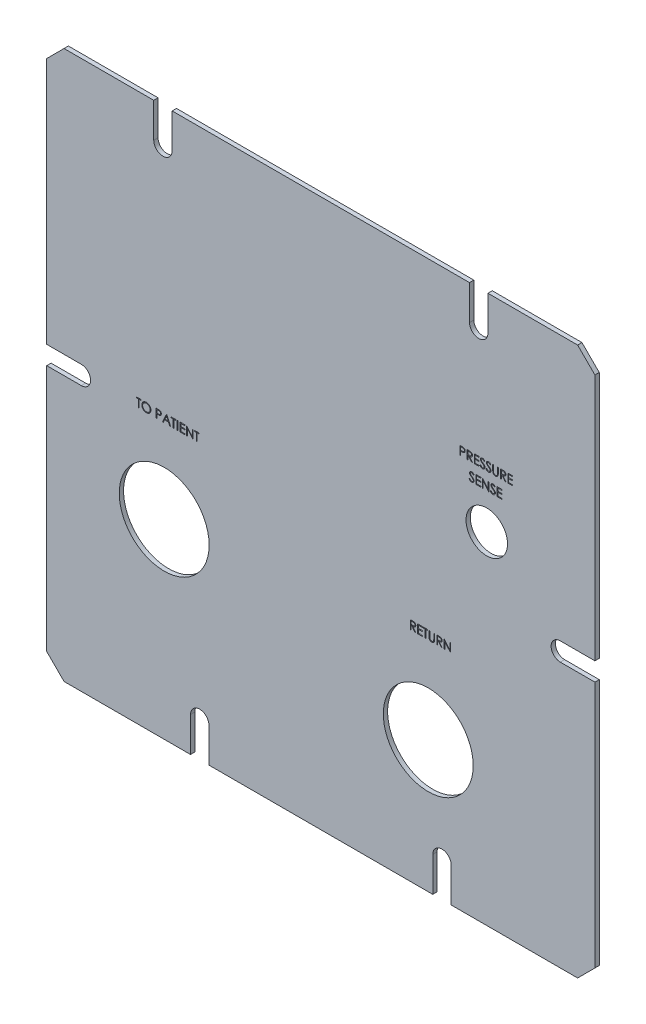
from build123d import *

# Parameters (mm, degrees)
SKETCH1_W               = 201.168
SKETCH1_H               = 201.168
BOSS_EXTRUDE1_DEPTH     = 1.5875
CUT_EXTRUDE1_REACH      = 144.256
SKETCH2_R               = 16.5
F_1_4_CLEARANCE_HOLE1_D = 6.7564
CHAMFER1_SIZE           = 6.35
SKETCH5_W               = 0.284935898
SKETCH5_H               = 3.175
CUT_EXTRUDE2_DEPTH      = 0.508
CUT_EXTRUDE3_REACH      = 144.256
SKETCH6_W               = 6.7564
SKETCH6_H               = 14.478
SKETCH6_W_2             = 14.478
SKETCH6_H_2             = 6.7564
CUT_EXTRUDE4_REACH      = 144.256
SKETCH7_R               = 7.62
CUT_EXTRUDE5_DEPTH      = 0.508


with BuildPart() as part:
    # Sketch1 → Boss-Extrude1 (new body)
    with BuildSketch(Plane.XY):
        Rectangle(SKETCH1_W, SKETCH1_H)
    extrude(amount=BOSS_EXTRUDE1_DEPTH)

    # Sketch2 → Cut-Extrude1 (cut, up to next)
    with BuildSketch(Plane.XY.offset(1.5875), mode=Mode.PRIVATE) as cut_extrude1_sk1:
        with Locations((-57.484, -30.636)):
            Circle(SKETCH2_R)
    cut_extrude1_tool1 = extrude(cut_extrude1_sk1.sketch, amount=-CUT_EXTRUDE1_REACH, mode=Mode.PRIVATE) & part.part
    # Sketch2 → Cut-Extrude1 (cut, up to next)
    with BuildSketch(Plane.XY.offset(1.5875), mode=Mode.PRIVATE) as cut_extrude1_sk2:
        with Locations((39.4206, -52.284)):
            Circle(SKETCH2_R)
    cut_extrude1_tool2 = extrude(cut_extrude1_sk2.sketch, amount=-CUT_EXTRUDE1_REACH, mode=Mode.PRIVATE) & part.part
    add(cut_extrude1_tool1.solids().sort_by_distance((-57.484, -30.636, 1.5875))[0], mode=Mode.SUBTRACT)
    add(cut_extrude1_tool2.solids().sort_by_distance((39.4206, -52.284, 1.5875))[0], mode=Mode.SUBTRACT)

    # 1/4 Clearance Hole1 (through all)
    with Locations(Plane.XY.offset(1.5875)):
        with Locations((-57.94375, 87.884), (57.94375, 87.884), (87.884, 0), (-87.884, 0), (-44.45, -87.884), (44.45, -87.884)):
            Hole(F_1_4_CLEARANCE_HOLE1_D / 2)

    # Chamfer1
    chamfer1_edges = [part.edges().sort_by_distance(p)[0] for p in [
        (100.584, -100.584, 0.79375),
        (-100.584, -100.584, 0.79375),
        (-100.584, 100.584, 0.79375),
        (100.584, 100.584, 0.79375),
    ]]
    chamfer(chamfer1_edges, length=CHAMFER1_SIZE)

    # Sketch5 → Cut-Extrude2 (cut)
    # profile 1 of 15: a face of its own
    with BuildSketch(Plane.XY.offset(1.5875)):
        Polygon((-67.686953674, 2.849358974), (-67.686953674, 3.175), (-66.018043418, 3.175), (-66.018043418, 2.849358974), (-66.710030597, 2.849358974), (-66.710030597, 0), (-66.994966495, 0), (-66.994966495, 2.849358974), align=None)
    # profile 2 of 15: a face of its own
    with BuildSketch(Plane.XY.offset(1.5875)):
        with BuildLine():
            add(Edge.make_bspline(
                [(-64.0438447, 3.256410256), (-63.985054489, 3.2549212), (-63.869585666, 3.251996571), (-63.699882009, 3.229609098), (-63.537870744, 3.19087828), (-63.382232118, 3.139295432), (-63.234827775, 3.070484668), (-63.094548208, 2.98731314), (-62.961727187, 2.888909496), (-62.838154933, 2.776034411), (-62.725073271, 2.653222278), (-62.625445503, 2.522160174), (-62.541949994, 2.383640546), (-62.473382887, 2.23807965), (-62.419590577, 2.085806679), (-62.382471158, 1.926009834), (-62.358760122, 1.759724479), (-62.355988095, 1.646307252), (-62.354581879, 1.588772035)],
                knots=[0, 0, 0, 0, 1.065120563, 2.091984664, 3.0946048, 4.079830382, 5.057816894, 6.036188127, 7.030412546, 8.04752943, 9.064399622, 10.05169764, 11.02544977, 11.989514704, 12.962713494, 13.945757189, 14.957906945, 16, 16, 16, 16], degree=3))
            add(Edge.make_bspline(
                [(-62.354581879, 1.588772035), (-62.355987889, 1.531660637), (-62.358759298, 1.419087456), (-62.382498118, 1.253857332), (-62.419728168, 1.095025057), (-62.472883352, 0.942855786), (-62.541123608, 0.797188996), (-62.625175084, 0.658407974), (-62.724181754, 0.526467222), (-62.836855112, 0.402812161), (-62.9596832, 0.289421599), (-63.091427799, 0.190616618), (-63.229126025, 0.105595448), (-63.374549832, 0.037755973), (-63.52577058, -0.016465698), (-63.684141687, -0.053434155), (-63.848921061, -0.077280259), (-63.961289757, -0.080018484), (-64.018403995, -0.081410256)],
                knots=[0, 0, 0, 0, 1.043624062, 2.057103931, 3.04512605, 4.022047818, 4.998200453, 5.980619268, 6.982898556, 8.009068085, 9.034988726, 10.034168286, 11.015286542, 11.987931943, 12.962482838, 13.94673481, 14.956375938, 16, 16, 16, 16], degree=3))
            add(Edge.make_bspline(
                [(-64.018403995, -0.081410256), (-64.075938913, -0.080004741), (-64.189355551, -0.077234097), (-64.355849862, -0.053483822), (-64.515758958, -0.016344211), (-64.668625548, 0.036732206), (-64.814534877, 0.105327837), (-64.953772309, 0.188970381), (-65.085778964, 0.288218287), (-65.209460406, 0.400855109), (-65.32262575, 0.523475017), (-65.421286041, 0.654860377), (-65.504947393, 0.792433541), (-65.573312702, 0.936576295), (-65.62743689, 1.086591818), (-65.664361975, 1.243480794), (-65.688252446, 1.406348774), (-65.691005485, 1.517240546), (-65.692402392, 1.573507612)],
                knots=[0, 0, 0, 0, 1.053102029, 2.075944431, 3.073151272, 4.055350789, 5.033113405, 6.020478099, 7.024410459, 8.052272461, 9.079885166, 10.07527673, 11.055994387, 12.023226415, 12.992069828, 13.970394897, 14.97016774, 16, 16, 16, 16], degree=3))
            add(Edge.make_bspline(
                [(-65.692402392, 1.573507612), (-65.691917401, 1.611274391), (-65.690953538, 1.686331503), (-65.679349646, 1.797789061), (-65.662511531, 1.907454158), (-65.638379796, 2.015014947), (-65.606818784, 2.120208126), (-65.56957873, 2.223759175), (-65.524094728, 2.324618696), (-65.472677283, 2.423264487), (-65.415289786, 2.518158801), (-65.351902499, 2.607856709), (-65.284741843, 2.693110899), (-65.21111505, 2.771712109), (-65.133448703, 2.845946926), (-65.050482889, 2.914674534), (-64.962723853, 2.978514668), (-64.86979398, 3.036045977), (-64.773983116, 3.088078906), (-64.675216325, 3.132730157), (-64.574835006, 3.17105337), (-64.472369004, 3.20211469), (-64.368090418, 3.226636608), (-64.261771657, 3.243334708), (-64.15349742, 3.254968196), (-64.080552866, 3.255927501), (-64.0438447, 3.256410256)],
                knots=[0, 0, 0, 0, 1.037015668, 2.060948919, 3.074880161, 4.083647147, 5.086022904, 6.090072063, 7.104153813, 8.122640571, 9.144368836, 10.147691507, 11.138137339, 12.123020368, 13.103399296, 14.087645067, 15.080126199, 16.082011238, 17.087798457, 18.072939717, 19.057185487, 20.037253025, 21.01195951, 21.997135196, 22.992090687, 24, 24, 24, 24], degree=3))
        make_face()
        with BuildLine():
            add(Edge.make_bspline(
                [(-64.029852312, 2.930769231), (-64.059982729, 2.930401937), (-64.119955516, 2.929670862), (-64.209113631, 2.920040892), (-64.297099171, 2.906315921), (-64.383930306, 2.886738399), (-64.469243726, 2.860064722), (-64.553834653, 2.829366184), (-64.636931709, 2.791972766), (-64.718260566, 2.74972467), (-64.797104956, 2.702962435), (-64.871502192, 2.651280903), (-64.941644876, 2.595892072), (-65.007361268, 2.536666676), (-65.068458403, 2.473303109), (-65.126138811, 2.406761971), (-65.178090503, 2.335141327), (-65.225702419, 2.260383315), (-65.26830896, 2.182585309), (-65.306196103, 2.102566362), (-65.337187739, 2.019673747), (-65.362462895, 1.934806761), (-65.383417723, 1.848099815), (-65.396692783, 1.758895152), (-65.406428566, 1.667641015), (-65.407117855, 1.605971762), (-65.407466495, 1.574779647)],
                knots=[0, 0, 0, 0, 1.008559885, 2.007477868, 2.99961109, 3.989939068, 4.984837346, 5.991145699, 7.001802488, 8.033829008, 9.059044045, 10.069351652, 11.065060232, 12.050310815, 13.029377138, 14.011219647, 14.996725999, 15.989392538, 16.977580475, 17.965360261, 18.951710183, 19.937753436, 20.929683414, 21.935841486, 22.955955122, 24, 24, 24, 24], degree=3))
            add(Edge.make_bspline(
                [(-65.407466495, 1.574779647), (-65.406310013, 1.52891249), (-65.404034855, 1.438677602), (-65.384116202, 1.306445071), (-65.35343484, 1.179364983), (-65.308207086, 1.05813268), (-65.251646171, 0.94170608), (-65.181771778, 0.831118014), (-65.09898675, 0.726338592), (-65.004949122, 0.628099312), (-64.902149238, 0.538432047), (-64.792990262, 0.459725241), (-64.678641632, 0.393131657), (-64.558805156, 0.338879913), (-64.434120602, 0.29589065), (-64.303784538, 0.266427892), (-64.168665193, 0.247037301), (-64.076562384, 0.245175158), (-64.029852312, 0.244230769)],
                knots=[0, 0, 0, 0, 1.032063989, 2.030389145, 3.003944642, 3.970395727, 4.937377036, 5.913328081, 6.909231446, 7.93887556, 8.970685674, 9.976071282, 10.964166581, 11.944589148, 12.933237628, 13.927779006, 14.949070134, 16, 16, 16, 16], degree=3))
            add(Edge.make_bspline(
                [(-64.029852312, 0.244230769), (-63.99845655, 0.24466212), (-63.936189324, 0.245517617), (-63.8435741, 0.254134274), (-63.752627394, 0.267951755), (-63.663476768, 0.287845993), (-63.576223404, 0.31274453), (-63.490503118, 0.342324398), (-63.407228955, 0.379228061), (-63.325350388, 0.420002274), (-63.246976654, 0.466484417), (-63.172159564, 0.516411882), (-63.102784925, 0.57171913), (-63.037117696, 0.630064575), (-62.975769721, 0.692624637), (-62.919155857, 0.759317981), (-62.867466737, 0.830565577), (-62.8198729, 0.905210195), (-62.777415655, 0.983221081), (-62.740423186, 1.063530146), (-62.709039567, 1.145939638), (-62.683704423, 1.230568421), (-62.663851183, 1.317255762), (-62.650171541, 1.406117733), (-62.640602601, 1.496976565), (-62.639881352, 1.558429921), (-62.639517777, 1.589408053)],
                knots=[0, 0, 0, 0, 1.047197238, 2.076906641, 3.100256066, 4.114471768, 5.12198147, 6.126382909, 7.136867548, 8.15857795, 9.17633901, 10.174870724, 11.156907918, 12.133735059, 13.104061851, 14.077631395, 15.04955518, 16.038496417, 17.029181396, 18.010275684, 18.986308667, 19.968651475, 20.955262928, 21.950658345, 22.966943676, 24, 24, 24, 24], degree=3))
            add(Edge.make_bspline(
                [(-62.639517777, 1.589408053), (-62.639881643, 1.62017426), (-62.64060344, 1.6812047), (-62.650166971, 1.771429871), (-62.663865636, 1.859652427), (-62.683607521, 1.94552602), (-62.709053017, 2.029072539), (-62.740428667, 2.110213517), (-62.77742676, 2.189251237), (-62.819888507, 2.265990349), (-62.867618575, 2.339627433), (-62.919774067, 2.410023907), (-62.97725549, 2.475857751), (-63.038420527, 2.538754224), (-63.104796973, 2.597371881), (-63.176084154, 2.651730167), (-63.251416633, 2.703140923), (-63.331179197, 2.749519112), (-63.413496926, 2.792349166), (-63.497964588, 2.829044004), (-63.583625271, 2.860224427), (-63.670261145, 2.886819102), (-63.758601418, 2.906239244), (-63.848049177, 2.92005326), (-63.938480668, 2.92966751), (-63.999298446, 2.930400825), (-64.029852312, 2.930769231)],
                knots=[0, 0, 0, 0, 1.02996197, 2.043119294, 3.035359645, 4.018872909, 4.991431989, 5.957985074, 6.929999688, 7.912076566, 8.892894881, 9.867085534, 10.843653904, 11.817741046, 12.803660682, 13.806313499, 14.818574707, 15.856120519, 16.894564902, 17.924820532, 18.937903209, 19.946497019, 20.957711757, 21.963978472, 22.977135795, 24, 24, 24, 24], degree=3))
        make_face(mode=Mode.SUBTRACT)
    # profile 3 of 15: a face of its own
    with BuildSketch(Plane.XY.offset(1.5875)):
        with BuildLine():
            Line((-60.482145982, 3.175), (-59.859484724, 3.175))
            add(Edge.make_bspline(
                [(-59.859484724, 3.175), (-59.816657687, 3.174952923), (-59.734599184, 3.17486272), (-59.616929098, 3.172127915), (-59.510058841, 3.16847513), (-59.414218853, 3.163411556), (-59.32911425, 3.157427506), (-59.255130128, 3.149034585), (-59.191684959, 3.140271317), (-59.153669823, 3.131361898), (-59.13633268, 3.127298678)],
                knots=[0, 0, 0, 0, 1.415646017, 2.712440637, 3.8905458, 4.950247383, 5.884950622, 6.709939814, 7.411656543, 8, 8, 8, 8], degree=3))
            add(Edge.make_bspline(
                [(-59.13633268, 3.127298678), (-59.114385689, 3.121291623), (-59.07100886, 3.109419063), (-59.008505771, 3.085639471), (-58.949039068, 3.057443507), (-58.892404726, 3.025308933), (-58.839298693, 2.987857028), (-58.788928642, 2.946605961), (-58.741739088, 2.900603324), (-58.697995397, 2.850365081), (-58.657822759, 2.796734605), (-58.62323369, 2.738911296), (-58.594271134, 2.677868471), (-58.569430595, 2.613648589), (-58.551552211, 2.545712367), (-58.538083952, 2.474531849), (-58.529535376, 2.400114666), (-58.528716623, 2.349260357), (-58.528299828, 2.323372396)],
                knots=[0, 0, 0, 0, 0.999701418, 1.975846123, 2.934577507, 3.890451536, 4.834027766, 5.787354733, 6.749476667, 7.726910423, 8.712836071, 9.690891519, 10.682875813, 11.679750201, 12.712814741, 13.765529915, 14.8625177, 16, 16, 16, 16], degree=3))
            add(Edge.make_bspline(
                [(-58.528299828, 2.323372396), (-58.52868212, 2.297266841), (-58.529430101, 2.24618956), (-58.538407446, 2.171465674), (-58.550499834, 2.100056849), (-58.569093589, 2.032121418), (-58.593446449, 1.968062827), (-58.62201424, 1.906902138), (-58.656470728, 1.849679864), (-58.696062824, 1.796188264), (-58.740106056, 1.74637713), (-58.788414078, 1.700607423), (-58.840791865, 1.659147059), (-58.897072957, 1.62190309), (-58.957806034, 1.589739179), (-59.022069987, 1.560930767), (-59.090423398, 1.536736305), (-59.137724107, 1.524009035), (-59.161773386, 1.517538061)],
                knots=[0, 0, 0, 0, 1.121902311, 2.195077645, 3.232258892, 4.234102512, 5.217864754, 6.176164875, 7.132989551, 8.084763148, 9.034132444, 9.988522005, 10.94243251, 11.903244335, 12.886203696, 13.894208494, 14.929344452, 16, 16, 16, 16], degree=3))
            add(Edge.make_bspline(
                [(-59.161773386, 1.517538061), (-59.18166461, 1.513308071), (-59.225257385, 1.504037802), (-59.29705114, 1.493688702), (-59.380640169, 1.484855307), (-59.47591038, 1.478232132), (-59.582776258, 1.472562155), (-59.701295613, 1.468055384), (-59.831701097, 1.465579017), (-59.92266144, 1.465451298), (-59.970151791, 1.465384615)],
                knots=[0, 0, 0, 0, 0.601384939, 1.31797006, 2.144135048, 3.087295005, 4.142315834, 5.309527816, 6.595305764, 8, 8, 8, 8], degree=3))
            Line((-59.970151791, 1.465384615), (-60.197210084, 1.465384615))
            Line((-60.197210084, 1.465384615), (-60.197210084, 0))
            Line((-60.197210084, 0), (-60.482145982, 0))
            Line((-60.482145982, 0), (-60.482145982, 3.175))
        make_face()
        with BuildLine():
            Line((-60.197210084, 2.849358974), (-60.197210084, 1.791025641))
            Line((-60.197210084, 1.791025641), (-59.641330677, 1.784029447))
            add(Edge.make_bspline(
                [(-59.641330677, 1.784029447), (-59.61418903, 1.784015419), (-59.56179264, 1.783988339), (-59.486104066, 1.787603506), (-59.415882784, 1.791776847), (-59.351344491, 1.797887291), (-59.292460093, 1.806524432), (-59.239131406, 1.815243652), (-59.191771943, 1.827857802), (-59.136346238, 1.8448423), (-59.074584916, 1.873809745), (-59.007395068, 1.915855716), (-58.950453179, 1.969450359), (-58.901178724, 2.029709891), (-58.862075535, 2.096746959), (-58.833449742, 2.16847378), (-58.816630263, 2.244154758), (-58.814374931, 2.295941855), (-58.813235725, 2.322100361)],
                knots=[0, 0, 0, 0, 1.160613943, 2.240541288, 3.23993089, 4.169200891, 5.011653406, 5.7853311, 6.478053781, 7.106038997, 8.262395093, 9.384106736, 10.481365981, 11.59014053, 12.70357646, 13.786202915, 14.881775077, 16, 16, 16, 16], degree=3))
            add(Edge.make_bspline(
                [(-58.813235725, 2.322100361), (-58.814381126, 2.347626012), (-58.816658041, 2.398367848), (-58.833581574, 2.472734295), (-58.86201988, 2.543705256), (-58.901441219, 2.609902269), (-58.949284959, 2.669944969), (-59.00489222, 2.722103078), (-59.068132107, 2.764032765), (-59.126958717, 2.791095813), (-59.179211221, 2.80761967), (-59.224597356, 2.819181061), (-59.275842468, 2.82841179), (-59.332963239, 2.835886196), (-59.395516939, 2.842284693), (-59.464040982, 2.846626258), (-59.538275787, 2.849167579), (-59.58981109, 2.849293631), (-59.61652599, 2.849358974)],
                knots=[0, 0, 0, 0, 1.120700087, 2.227813068, 3.331159281, 4.466773991, 5.599788987, 6.693661531, 7.80175334, 8.91857717, 9.525282508, 10.207424825, 10.974604443, 11.810962634, 12.737642355, 13.736264703, 14.826523623, 16, 16, 16, 16], degree=3))
            Line((-59.61652599, 2.849358974), (-60.197210084, 2.849358974))
        make_face(mode=Mode.SUBTRACT)
    # profile 4 of 15: a face of its own
    with BuildSketch(Plane.XY.offset(1.5875)):
        Polygon((-56.574453674, 3.175), (-55.109069059, 0), (-55.418809644, 0), (-55.888190653, 1.017628205), (-57.327498546, 1.017628205), (-57.810235926, 0), (-58.121248546, 0), (-56.615158802, 3.175), align=None)
        Polygon((-56.597986326, 2.556154848), (-57.172946262, 1.343269231), (-56.038290813, 1.343269231), align=None, mode=Mode.SUBTRACT)
    # profile 5 of 15: a face of its own
    with BuildSketch(Plane.XY.offset(1.5875)):
        Polygon((-54.905543418, 2.849358974), (-54.905543418, 3.175), (-53.236633161, 3.175), (-53.236633161, 2.849358974), (-53.928620341, 2.849358974), (-53.928620341, 0), (-54.213556238, 0), (-54.213556238, 2.849358974), align=None)
    # profile 6 of 15: a face of its own
    with BuildSketch(Plane.XY.offset(1.5875)):
        with Locations((-52.605703674, 1.5875)):
            Rectangle(SKETCH5_W, SKETCH5_H)
    # profile 7 of 15: a face of its own
    with BuildSketch(Plane.XY.offset(1.5875)):
        Polygon((-51.649133161, 3.175), (-49.85810752, 3.175), (-49.85810752, 2.849358974), (-51.364197264, 2.849358974), (-51.364197264, 1.872435897), (-49.85810752, 1.872435897), (-49.85810752, 1.546794872), (-51.364197264, 1.546794872), (-51.364197264, 0.325641026), (-49.85810752, 0.325641026), (-49.85810752, 0), (-51.649133161, 0), align=None)
    # profile 8 of 15: a face of its own
    with BuildSketch(Plane.XY.offset(1.5875)):
        Polygon((-49.288235725, 0), (-49.288235725, 3.175), (-49.228450068, 3.175), (-47.13086393, 0.676086739), (-47.13086393, 3.175), (-46.845928033, 3.175), (-46.845928033, 0), (-46.910801831, 0), (-49.003299828, 2.493189103), (-49.003299828, 0), align=None)
    # profile 9 of 15: a face of its own
    with BuildSketch(Plane.XY.offset(1.5875)):
        Polygon((-46.398171623, 2.849358974), (-46.398171623, 3.175), (-44.729261366, 3.175), (-44.729261366, 2.849358974), (-45.421248546, 2.849358974), (-45.421248546, 0), (-45.706184443, 0), (-45.706184443, 2.849358974), align=None)
    # profile 10 of 15: a face of its own
    with BuildSketch(Plane.XY.offset(1.5875)):
        Polygon((45.225025641, -20.534), (45.225025641, -17.359), (45.284811298, -17.359), (47.382397436, -19.857913261), (47.382397436, -17.359), (47.667333333, -17.359), (47.667333333, -20.534), (47.602459535, -20.534), (45.509961538, -18.040810897), (45.509961538, -20.534), align=None)
    # profile 11 of 15: a face of its own
    with BuildSketch(Plane.XY.offset(1.5875)):
        with BuildLine():
            Line((42.538487179, -17.359), (43.17386879, -17.359))
            add(Edge.make_bspline(
                [(43.17386879, -17.359), (43.216269671, -17.359141139), (43.297684059, -17.359412141), (43.414318383, -17.360923226), (43.520297249, -17.365254248), (43.615565247, -17.36898132), (43.700120626, -17.375777582), (43.774222669, -17.382273311), (43.83753008, -17.390776561), (43.875853102, -17.398673623), (43.893204728, -17.402249199)],
                knots=[0, 0, 0, 0, 1.410062039, 2.707475311, 3.878576406, 4.937260626, 5.877586885, 6.699081471, 7.410979367, 8, 8, 8, 8], degree=3))
            add(Edge.make_bspline(
                [(43.893204728, -17.402249199), (43.916433594, -17.407988479), (43.962395791, -17.419344604), (44.028571923, -17.443347242), (44.091631345, -17.471123616), (44.151312114, -17.503747848), (44.207315296, -17.541462112), (44.260218335, -17.583615338), (44.310261291, -17.629976874), (44.355420342, -17.681715623), (44.398000767, -17.735995886), (44.433913307, -17.794691437), (44.464870899, -17.856070108), (44.48951844, -17.920756123), (44.509364887, -17.988122159), (44.52335869, -18.058778424), (44.531750839, -18.132403023), (44.532605236, -18.182620555), (44.533038462, -18.208083534)],
                knots=[0, 0, 0, 0, 1.027469482, 2.033020251, 3.019912614, 3.986113645, 4.951240523, 5.91722682, 6.890402269, 7.87763091, 8.8651537, 9.85103654, 10.82876324, 11.815024772, 12.821070561, 13.842952187, 14.906261191, 16, 16, 16, 16], degree=3))
            add(Edge.make_bspline(
                [(44.533038462, -18.208083534), (44.53170587, -18.250388236), (44.52910564, -18.332935667), (44.504862153, -18.452733752), (44.465150596, -18.564484059), (44.410428755, -18.66804588), (44.340742516, -18.761400537), (44.256990742, -18.843397593), (44.159126708, -18.912013799), (44.068022972, -18.959595987), (43.987546519, -18.990069554), (43.921294871, -19.011511108), (43.849025542, -19.028077319), (43.771430959, -19.042918296), (43.688188215, -19.054123047), (43.599496822, -19.062329601), (43.505293527, -19.067458631), (43.4405788, -19.068222449), (43.40728726, -19.068615385)],
                knots=[0, 0, 0, 0, 1.260483769, 2.459530307, 3.627416485, 4.787058657, 5.939039949, 7.08810263, 8.267026773, 9.491475466, 10.141966685, 10.831826277, 11.566392101, 12.351337768, 13.187381173, 14.07005841, 15.007169909, 16, 16, 16, 16], degree=3))
            Line((43.40728726, -19.068615385), (44.57374359, -20.534))
            Line((44.57374359, -20.534), (44.221389824, -20.534))
            Line((44.221389824, -20.534), (43.054933494, -19.068615385))
            Line((43.054933494, -19.068615385), (42.823423077, -19.068615385))
            Line((42.823423077, -19.068615385), (42.823423077, -20.534))
            Line((42.823423077, -20.534), (42.538487179, -20.534))
            Line((42.538487179, -20.534), (42.538487179, -17.359))
        make_face()
        with BuildLine():
            Line((42.823423077, -17.684641026), (42.823423077, -18.742974359))
            Line((42.823423077, -18.742974359), (43.404743189, -18.747426482))
            add(Edge.make_bspline(
                [(43.404743189, -18.747426482), (43.431884939, -18.74743849), (43.48449338, -18.747461764), (43.560603269, -18.743838838), (43.63146937, -18.7397174), (43.696820624, -18.73341335), (43.756686224, -18.725288914), (43.811036249, -18.715126207), (43.859959417, -18.703286121), (43.917017377, -18.684960361), (43.980731945, -18.65592633), (44.049975484, -18.613684771), (44.10894189, -18.560554212), (44.158760237, -18.49979972), (44.198791935, -18.433001123), (44.227015013, -18.360959131), (44.244924229, -18.285492467), (44.247036552, -18.233623755), (44.248102564, -18.207447516)],
                knots=[0, 0, 0, 0, 1.146690395, 2.22261258, 3.21895312, 4.145990853, 4.996080663, 5.770904154, 6.481378293, 7.121626537, 8.300444488, 9.431385265, 10.535395872, 11.636531494, 12.74115979, 13.810798291, 14.895190096, 16, 16, 16, 16], degree=3))
            add(Edge.make_bspline(
                [(44.248102564, -18.207447516), (44.247012069, -18.181914553), (44.244851104, -18.131317536), (44.227208293, -18.05724396), (44.197372925, -17.987333227), (44.157166324, -17.92186973), (44.108181376, -17.86244667), (44.050743075, -17.811603895), (43.986421933, -17.769649024), (43.926304489, -17.742838978), (43.872570596, -17.726401683), (43.825916548, -17.714834556), (43.773201136, -17.705541359), (43.714168398, -17.698095475), (43.649070347, -17.691695633), (43.577577828, -17.687385091), (43.500165178, -17.684832514), (43.446510461, -17.684706341), (43.418735577, -17.684641026)],
                knots=[0, 0, 0, 0, 1.101028733, 2.181837193, 3.264309656, 4.369019818, 5.486613113, 6.575447106, 7.666700264, 8.788928104, 9.402425223, 10.0903467, 10.862060571, 11.710948788, 12.657782767, 13.684531032, 14.801375019, 16, 16, 16, 16], degree=3))
            Line((43.418735577, -17.684641026), (42.823423077, -17.684641026))
        make_face(mode=Mode.SUBTRACT)
    # profile 12 of 15: a face of its own
    with BuildSketch(Plane.XY.offset(1.5875)):
        with BuildLine():
            Line((39.689128205, -17.359), (39.974064103, -17.359))
            Line((39.974064103, -17.359), (39.974064103, -19.261328726))
            add(Edge.make_bspline(
                [(39.974064103, -19.261328726), (39.974021699, -19.288253393), (39.973941231, -19.33934759), (39.974478726, -19.412071691), (39.97598401, -19.476725993), (39.976933026, -19.533559716), (39.97904425, -19.582312065), (39.98076605, -19.623247168), (39.982979984, -19.656171195), (39.98564074, -19.675385321), (39.986784455, -19.683644431)],
                knots=[0, 0, 0, 0, 1.528628734, 2.90083645, 4.128790002, 5.200304208, 6.127813768, 6.898992206, 7.526736466, 8, 8, 8, 8], degree=3))
            add(Edge.make_bspline(
                [(39.986784455, -19.683644431), (39.99148115, -19.713441138), (40.000609898, -19.771355614), (40.023874826, -19.853822412), (40.056366416, -19.928145949), (40.094868319, -19.996645478), (40.145607188, -20.057414397), (40.206388966, -20.113395682), (40.280028799, -20.162355819), (40.361908063, -20.207124056), (40.450159671, -20.243105952), (40.540339892, -20.270314218), (40.631093166, -20.286895791), (40.691850115, -20.288815795), (40.722020833, -20.289769231)],
                knots=[0, 0, 0, 0, 1.035780045, 2.013197591, 2.933192213, 3.817615948, 4.702609284, 5.640816605, 6.646850145, 7.73207398, 8.84249596, 9.914020372, 10.964143139, 12, 12, 12, 12], degree=3))
            add(Edge.make_bspline(
                [(40.722020833, -20.289769231), (40.747923155, -20.288795095), (40.799578193, -20.28685245), (40.876328313, -20.274822438), (40.951076983, -20.25314121), (41.024193314, -20.225165144), (41.092728849, -20.188201258), (41.156721829, -20.145501282), (41.213839112, -20.09541713), (41.265961725, -20.039990389), (41.311350559, -19.977452142), (41.35069438, -19.909164117), (41.382921474, -19.834098638), (41.398835957, -19.781344269), (41.407011819, -19.754242388)],
                knots=[0, 0, 0, 0, 0.994687771, 1.983630487, 2.973142513, 3.978332533, 4.983357753, 5.956394766, 6.925816176, 7.893390482, 8.871859704, 9.88551698, 10.913711441, 12, 12, 12, 12], degree=3))
            add(Edge.make_bspline(
                [(41.407011819, -19.754242388), (41.409733361, -19.743040467), (41.415798054, -19.718078072), (41.421465016, -19.675876616), (41.427367364, -19.626084122), (41.431462724, -19.568342834), (41.43545526, -19.502846238), (41.437843833, -19.429253133), (41.438947856, -19.347830747), (41.439276859, -19.291009893), (41.439448718, -19.261328726)],
                knots=[0, 0, 0, 0, 0.558680831, 1.244966039, 2.062412453, 2.990489873, 4.051219941, 5.244515665, 6.560634259, 8, 8, 8, 8], degree=3))
            Line((41.439448718, -19.261328726), (41.439448718, -17.359))
            Line((41.439448718, -17.359), (41.724384615, -17.359))
            Line((41.724384615, -17.359), (41.724384615, -19.276593149))
            add(Edge.make_bspline(
                [(41.724384615, -19.276593149), (41.724154092, -19.311153821), (41.723704211, -19.378601075), (41.719802974, -19.477435522), (41.713582696, -19.571191441), (41.704794216, -19.659881434), (41.69314922, -19.743188135), (41.680199556, -19.821841747), (41.663708122, -19.895277676), (41.644446394, -19.964068512), (41.622426818, -20.029551085), (41.593905205, -20.091698185), (41.561770123, -20.152399105), (41.523656831, -20.210735746), (41.480829362, -20.266966405), (41.432341052, -20.320750066), (41.379795563, -20.372946201), (41.322319391, -20.422215911), (41.260859986, -20.467399496), (41.195600167, -20.507130332), (41.12704124, -20.540716042), (41.055361419, -20.568362059), (40.980530113, -20.589148874), (40.902545437, -20.604638479), (40.821229883, -20.613439849), (40.765926231, -20.614747886), (40.737921274, -20.615410256)],
                knots=[0, 0, 0, 0, 1.316592851, 2.569410997, 3.76748051, 4.895814652, 5.963796859, 6.97159953, 7.931736103, 8.829262218, 9.692595152, 10.560224239, 11.431080259, 12.30701507, 13.211635791, 14.121146779, 15.063487852, 16.031507147, 17.00238618, 17.966455255, 18.938106653, 19.907068911, 20.888905087, 21.893141452, 22.933117798, 24, 24, 24, 24], degree=3))
            add(Edge.make_bspline(
                [(40.737921274, -20.615410256), (40.707378588, -20.614698362), (40.647453948, -20.613301628), (40.559154415, -20.605298134), (40.474505108, -20.590222876), (40.392611991, -20.571027784), (40.314589998, -20.544553965), (40.239393802, -20.513622095), (40.168311284, -20.475633437), (40.100189274, -20.433366574), (40.036848245, -20.385809938), (39.978702744, -20.333975637), (39.925656776, -20.278694009), (39.878604458, -20.219366534), (39.836766227, -20.156454629), (39.800725248, -20.089780318), (39.769779662, -20.019369417), (39.753807991, -19.970426157), (39.745733774, -19.945683694)],
                knots=[0, 0, 0, 0, 1.13879206, 2.234305948, 3.301075583, 4.341971843, 5.366689343, 6.369221514, 7.369726634, 8.367512178, 9.355451585, 10.318319045, 11.268648973, 12.207971039, 13.137398894, 14.081662264, 15.030215811, 16, 16, 16, 16], degree=3))
            add(Edge.make_bspline(
                [(39.745733774, -19.945683694), (39.741037352, -19.928781287), (39.730850708, -19.89211959), (39.719942045, -19.83144399), (39.710771664, -19.761580457), (39.702148765, -19.682524211), (39.697060638, -19.594213975), (39.692599819, -19.49668803), (39.689096779, -19.38982845), (39.689117437, -19.315393282), (39.689128205, -19.276593149)],
                knots=[0, 0, 0, 0, 0.625038921, 1.35572334, 2.194682327, 3.136881307, 4.189498639, 5.346923369, 6.617055217, 8, 8, 8, 8], degree=3))
            Line((39.689128205, -19.276593149), (39.689128205, -17.359))
        make_face()
    # profile 13 of 15: a face of its own
    with BuildSketch(Plane.XY.offset(1.5875)):
        Polygon((37.53175641, -17.684641026), (37.53175641, -17.359), (39.200666667, -17.359), (39.200666667, -17.684641026), (38.508679487, -17.684641026), (38.508679487, -20.534), (38.22374359, -20.534), (38.22374359, -17.684641026), align=None)
    # profile 14 of 15: a face of its own
    with BuildSketch(Plane.XY.offset(1.5875)):
        Polygon((35.537205128, -17.359), (37.328230769, -17.359), (37.328230769, -17.684641026), (35.822141026, -17.684641026), (35.822141026, -18.661564103), (37.328230769, -18.661564103), (37.328230769, -18.987205128), (35.822141026, -18.987205128), (35.822141026, -20.208358974), (37.328230769, -20.208358974), (37.328230769, -20.534), (35.537205128, -20.534), align=None)
    # profile 15 of 15: a face of its own
    with BuildSketch(Plane.XY.offset(1.5875)):
        with BuildLine():
            Line((32.850666667, -17.359), (33.486048277, -17.359))
            add(Edge.make_bspline(
                [(33.486048277, -17.359), (33.528449158, -17.359141139), (33.609863546, -17.359412141), (33.72649787, -17.360923226), (33.832476737, -17.365254248), (33.927744734, -17.36898132), (34.012300114, -17.375777582), (34.086402156, -17.382273311), (34.149709567, -17.390776561), (34.188032589, -17.398673623), (34.205384215, -17.402249199)],
                knots=[0, 0, 0, 0, 1.410062039, 2.707475311, 3.878576406, 4.937260626, 5.877586885, 6.699081471, 7.410979367, 8, 8, 8, 8], degree=3))
            add(Edge.make_bspline(
                [(34.205384215, -17.402249199), (34.228613081, -17.407988479), (34.274575279, -17.419344604), (34.34075141, -17.443347242), (34.403810832, -17.471123616), (34.463491602, -17.503747848), (34.519494784, -17.541462112), (34.572397823, -17.583615338), (34.622440779, -17.629976874), (34.667599829, -17.681715623), (34.710180254, -17.735995886), (34.746092794, -17.794691437), (34.777050386, -17.856070108), (34.801697927, -17.920756123), (34.821544374, -17.988122159), (34.835538177, -18.058778424), (34.843930326, -18.132403023), (34.844784723, -18.182620555), (34.845217949, -18.208083534)],
                knots=[0, 0, 0, 0, 1.027469482, 2.033020251, 3.019912614, 3.986113645, 4.951240523, 5.91722682, 6.890402269, 7.87763091, 8.8651537, 9.85103654, 10.82876324, 11.815024772, 12.821070561, 13.842952187, 14.906261191, 16, 16, 16, 16], degree=3))
            add(Edge.make_bspline(
                [(34.845217949, -18.208083534), (34.843885358, -18.250388236), (34.841285127, -18.332935667), (34.81704164, -18.452733752), (34.777330083, -18.564484059), (34.722608242, -18.66804588), (34.652922004, -18.761400537), (34.569170229, -18.843397593), (34.471306196, -18.912013799), (34.380202459, -18.959595987), (34.299726006, -18.990069554), (34.233474358, -19.011511108), (34.161205029, -19.028077319), (34.083610447, -19.042918296), (34.000367702, -19.054123047), (33.911676309, -19.062329601), (33.817473014, -19.067458631), (33.752758287, -19.068222449), (33.719466747, -19.068615385)],
                knots=[0, 0, 0, 0, 1.260483769, 2.459530307, 3.627416485, 4.787058657, 5.939039949, 7.08810263, 8.267026773, 9.491475466, 10.141966685, 10.831826277, 11.566392101, 12.351337768, 13.187381173, 14.07005841, 15.007169909, 16, 16, 16, 16], degree=3))
            Line((33.719466747, -19.068615385), (34.885923077, -20.534))
            Line((34.885923077, -20.534), (34.533569311, -20.534))
            Line((34.533569311, -20.534), (33.367112981, -19.068615385))
            Line((33.367112981, -19.068615385), (33.135602564, -19.068615385))
            Line((33.135602564, -19.068615385), (33.135602564, -20.534))
            Line((33.135602564, -20.534), (32.850666667, -20.534))
            Line((32.850666667, -20.534), (32.850666667, -17.359))
        make_face()
        with BuildLine():
            Line((33.135602564, -17.684641026), (33.135602564, -18.742974359))
            Line((33.135602564, -18.742974359), (33.716922676, -18.747426482))
            add(Edge.make_bspline(
                [(33.716922676, -18.747426482), (33.744064426, -18.74743849), (33.796672867, -18.747461764), (33.872782756, -18.743838838), (33.943648857, -18.7397174), (34.009000111, -18.73341335), (34.068865711, -18.725288914), (34.123215736, -18.715126207), (34.172138905, -18.703286121), (34.229196865, -18.684960361), (34.292911432, -18.65592633), (34.362154971, -18.613684771), (34.421121377, -18.560554212), (34.470939724, -18.49979972), (34.510971422, -18.433001123), (34.5391945, -18.360959131), (34.557103716, -18.285492467), (34.559216039, -18.233623755), (34.560282051, -18.207447516)],
                knots=[0, 0, 0, 0, 1.146690395, 2.22261258, 3.21895312, 4.145990853, 4.996080663, 5.770904154, 6.481378293, 7.121626537, 8.300444488, 9.431385265, 10.535395872, 11.636531494, 12.74115979, 13.810798291, 14.895190096, 16, 16, 16, 16], degree=3))
            add(Edge.make_bspline(
                [(34.560282051, -18.207447516), (34.559191556, -18.181914553), (34.557030591, -18.131317536), (34.53938778, -18.05724396), (34.509552413, -17.987333227), (34.469345811, -17.92186973), (34.420360863, -17.86244667), (34.362922562, -17.811603895), (34.298601421, -17.769649024), (34.238483976, -17.742838978), (34.184750084, -17.726401683), (34.138096035, -17.714834556), (34.085380623, -17.705541359), (34.026347885, -17.698095475), (33.961249835, -17.691695633), (33.889757315, -17.687385091), (33.812344665, -17.684832514), (33.758689949, -17.684706341), (33.730915064, -17.684641026)],
                knots=[0, 0, 0, 0, 1.101028733, 2.181837193, 3.264309656, 4.369019818, 5.486613113, 6.575447106, 7.666700264, 8.788928104, 9.402425223, 10.0903467, 10.862060571, 11.710948788, 12.657782767, 13.684531032, 14.801375019, 16, 16, 16, 16], degree=3))
            Line((33.730915064, -17.684641026), (33.135602564, -17.684641026))
        make_face(mode=Mode.SUBTRACT)
    extrude(amount=-CUT_EXTRUDE2_DEPTH, mode=Mode.SUBTRACT)

    # Sketch6 → Cut-Extrude3 (cut, up to next)
    with BuildSketch(Plane.XY.offset(1.5875), mode=Mode.PRIVATE) as cut_extrude3_sk1:
        with Locations((-57.94375, 95.123)):
            Rectangle(SKETCH6_W, SKETCH6_H)
    cut_extrude3_tool1 = extrude(cut_extrude3_sk1.sketch, amount=-CUT_EXTRUDE3_REACH, mode=Mode.PRIVATE) & part.part
    # Sketch6 → Cut-Extrude3 (cut, up to next)
    with BuildSketch(Plane.XY.offset(1.5875), mode=Mode.PRIVATE) as cut_extrude3_sk2:
        with Locations((57.94375, 95.123)):
            Rectangle(SKETCH6_W, SKETCH6_H)
    cut_extrude3_tool2 = extrude(cut_extrude3_sk2.sketch, amount=-CUT_EXTRUDE3_REACH, mode=Mode.PRIVATE) & part.part
    # Sketch6 → Cut-Extrude3 (cut, up to next)
    with BuildSketch(Plane.XY.offset(1.5875), mode=Mode.PRIVATE) as cut_extrude3_sk3:
        with Locations((-44.45, -95.123)):
            Rectangle(SKETCH6_W, SKETCH6_H)
    cut_extrude3_tool3 = extrude(cut_extrude3_sk3.sketch, amount=-CUT_EXTRUDE3_REACH, mode=Mode.PRIVATE) & part.part
    # Sketch6 → Cut-Extrude3 (cut, up to next)
    with BuildSketch(Plane.XY.offset(1.5875), mode=Mode.PRIVATE) as cut_extrude3_sk4:
        with Locations((44.45, -95.123)):
            Rectangle(SKETCH6_W, SKETCH6_H)
    cut_extrude3_tool4 = extrude(cut_extrude3_sk4.sketch, amount=-CUT_EXTRUDE3_REACH, mode=Mode.PRIVATE) & part.part
    # Sketch6 → Cut-Extrude3 (cut, up to next)
    with BuildSketch(Plane.XY.offset(1.5875), mode=Mode.PRIVATE) as cut_extrude3_sk5:
        with Locations((-95.123, 0)):
            Rectangle(SKETCH6_W_2, SKETCH6_H_2)
    cut_extrude3_tool5 = extrude(cut_extrude3_sk5.sketch, amount=-CUT_EXTRUDE3_REACH, mode=Mode.PRIVATE) & part.part
    # Sketch6 → Cut-Extrude3 (cut, up to next)
    with BuildSketch(Plane.XY.offset(1.5875), mode=Mode.PRIVATE) as cut_extrude3_sk6:
        with Locations((95.123, 0)):
            Rectangle(SKETCH6_W_2, SKETCH6_H_2)
    cut_extrude3_tool6 = extrude(cut_extrude3_sk6.sketch, amount=-CUT_EXTRUDE3_REACH, mode=Mode.PRIVATE) & part.part
    add(cut_extrude3_tool1.solids().sort_by_distance((-57.94375, 95.123, 1.5875))[0], mode=Mode.SUBTRACT)
    add(cut_extrude3_tool2.solids().sort_by_distance((57.94375, 95.123, 1.5875))[0], mode=Mode.SUBTRACT)
    add(cut_extrude3_tool3.solids().sort_by_distance((-44.45, -95.123, 1.5875))[0], mode=Mode.SUBTRACT)
    add(cut_extrude3_tool4.solids().sort_by_distance((44.45, -95.123, 1.5875))[0], mode=Mode.SUBTRACT)
    add(cut_extrude3_tool5.solids().sort_by_distance((-95.123, 0, 1.5875))[0], mode=Mode.SUBTRACT)
    add(cut_extrude3_tool6.solids().sort_by_distance((95.123, 0, 1.5875))[0], mode=Mode.SUBTRACT)

    # Sketch7 → Cut-Extrude4 (cut, up to next)
    with BuildSketch(Plane.XY.offset(1.5875), mode=Mode.PRIVATE) as cut_extrude4_sk1:
        with Locations((60.8965, 24.511)):
            Circle(SKETCH7_R)
    cut_extrude4_tool1 = extrude(cut_extrude4_sk1.sketch, amount=-CUT_EXTRUDE4_REACH, mode=Mode.PRIVATE) & part.part
    add(cut_extrude4_tool1.solids().sort_by_distance((60.8965, 24.511, 1.5875))[0], mode=Mode.SUBTRACT)

    # Sketch8 → Cut-Extrude5 (cut)
    # profile 1 of 13: a face of its own
    with BuildSketch(Plane.XY.offset(1.5875)):
        with BuildLine():
            Line((51.035023283, 47.089886213), (51.657684541, 47.089886213))
            add(Edge.make_bspline(
                [(51.657684541, 47.089886213), (51.700511577, 47.089839136), (51.782570081, 47.089748934), (51.900240167, 47.087014129), (52.007110424, 47.083361344), (52.102950412, 47.078297769), (52.188055015, 47.072313719), (52.262039137, 47.063920798), (52.325484306, 47.05515753), (52.363499442, 47.046248111), (52.380836584, 47.042184891)],
                knots=[0, 0, 0, 0, 1.415646017, 2.712440637, 3.8905458, 4.950247383, 5.884950622, 6.709939814, 7.411656543, 8, 8, 8, 8], degree=3))
            add(Edge.make_bspline(
                [(52.380836584, 47.042184891), (52.402783576, 47.036177837), (52.446160405, 47.024305276), (52.508663494, 47.000525684), (52.568130197, 46.97232972), (52.624764539, 46.940195146), (52.677870572, 46.902743242), (52.728240623, 46.861492174), (52.775430177, 46.815489537), (52.819173868, 46.765251294), (52.859346506, 46.711620818), (52.893935575, 46.65379751), (52.922898131, 46.592754684), (52.94773867, 46.528534802), (52.965617054, 46.46059858), (52.979085313, 46.389418062), (52.987633889, 46.315000879), (52.988452642, 46.264146571), (52.988869437, 46.238258609)],
                knots=[0, 0, 0, 0, 0.999701418, 1.975846123, 2.934577507, 3.890451536, 4.834027766, 5.787354733, 6.749476667, 7.726910423, 8.712836071, 9.690891519, 10.682875813, 11.679750201, 12.712814741, 13.765529915, 14.8625177, 16, 16, 16, 16], degree=3))
            add(Edge.make_bspline(
                [(52.988869437, 46.238258609), (52.988487144, 46.212153054), (52.987739163, 46.161075774), (52.978761819, 46.086351887), (52.966669431, 46.014943062), (52.948075676, 45.947007632), (52.923722816, 45.88294904), (52.895155025, 45.821788351), (52.860698537, 45.764566077), (52.821106441, 45.711074478), (52.777063209, 45.661263343), (52.728755186, 45.615493636), (52.6763774, 45.574033272), (52.620096308, 45.536789303), (52.559363231, 45.504625393), (52.495099277, 45.47581698), (52.426745867, 45.451622518), (52.379445158, 45.438895248), (52.355395879, 45.432424274)],
                knots=[0, 0, 0, 0, 1.121902311, 2.195077645, 3.232258892, 4.234102512, 5.217864754, 6.176164875, 7.132989551, 8.084763148, 9.034132444, 9.988522005, 10.94243251, 11.903244335, 12.886203696, 13.894208494, 14.929344452, 16, 16, 16, 16], degree=3))
            add(Edge.make_bspline(
                [(52.355395879, 45.432424274), (52.335504655, 45.428194284), (52.29191188, 45.418924015), (52.220118125, 45.408574915), (52.136529096, 45.39974152), (52.041258885, 45.393118345), (51.934393007, 45.387448368), (51.815873652, 45.382941597), (51.685468168, 45.38046523), (51.594507825, 45.380337511), (51.547017474, 45.380270829)],
                knots=[0, 0, 0, 0, 0.601384939, 1.31797006, 2.144135048, 3.087295005, 4.142315834, 5.309527816, 6.595305764, 8, 8, 8, 8], degree=3))
            Line((51.547017474, 45.380270829), (51.31995918, 45.380270829))
            Line((51.31995918, 45.380270829), (51.31995918, 43.914886213))
            Line((51.31995918, 43.914886213), (51.035023283, 43.914886213))
            Line((51.035023283, 43.914886213), (51.035023283, 47.089886213))
        make_face()
        with BuildLine():
            Line((51.31995918, 46.764245188), (51.31995918, 45.705911854))
            Line((51.31995918, 45.705911854), (51.875838587, 45.69891566))
            add(Edge.make_bspline(
                [(51.875838587, 45.69891566), (51.902980234, 45.698901633), (51.955376624, 45.698874552), (52.031065198, 45.702489719), (52.10128648, 45.70666306), (52.165824774, 45.712773505), (52.224709171, 45.721410645), (52.278037858, 45.730129865), (52.325397322, 45.742744015), (52.380823027, 45.759728514), (52.442584349, 45.788695958), (52.509774197, 45.83074193), (52.566716086, 45.884336572), (52.615990541, 45.944596105), (52.65509373, 46.011633172), (52.683719523, 46.083359993), (52.700539001, 46.159040971), (52.702794334, 46.210828068), (52.703933539, 46.236986574)],
                knots=[0, 0, 0, 0, 1.160613943, 2.240541288, 3.23993089, 4.169200891, 5.011653406, 5.7853311, 6.478053781, 7.106038997, 8.262395093, 9.384106736, 10.481365981, 11.59014053, 12.70357646, 13.786202915, 14.881775077, 16, 16, 16, 16], degree=3))
            add(Edge.make_bspline(
                [(52.703933539, 46.236986574), (52.702788139, 46.262512225), (52.700511224, 46.313254061), (52.683587691, 46.387620508), (52.655149385, 46.458591469), (52.615728045, 46.524788482), (52.567884306, 46.584831183), (52.512277045, 46.636989291), (52.449037158, 46.678918978), (52.390210548, 46.705982027), (52.337958044, 46.722505884), (52.292571909, 46.734067275), (52.241326797, 46.743298003), (52.184206025, 46.750772409), (52.121652326, 46.757170906), (52.053128283, 46.761512471), (51.978893478, 46.764053792), (51.927358175, 46.764179845), (51.900643275, 46.764245188)],
                knots=[0, 0, 0, 0, 1.120700087, 2.227813068, 3.331159281, 4.466773991, 5.599788987, 6.693661531, 7.80175334, 8.91857717, 9.525282508, 10.207424825, 10.974604443, 11.810962634, 12.737642355, 13.736264703, 14.826523623, 16, 16, 16, 16], degree=3))
            Line((51.900643275, 46.764245188), (51.31995918, 46.764245188))
        make_face(mode=Mode.SUBTRACT)
    # profile 2 of 13: a face of its own
    with BuildSketch(Plane.XY.offset(1.5875)):
        with BuildLine():
            Line((53.640151488, 47.089886213), (54.275533099, 47.089886213))
            add(Edge.make_bspline(
                [(54.275533099, 47.089886213), (54.31793398, 47.089745074), (54.399348368, 47.089474073), (54.515982692, 47.087962988), (54.621961558, 47.083631965), (54.717229555, 47.079904893), (54.801784935, 47.073108632), (54.875886977, 47.066612902), (54.939194389, 47.058109652), (54.977517411, 47.05021259), (54.994869036, 47.046637014)],
                knots=[0, 0, 0, 0, 1.410062039, 2.707475311, 3.878576406, 4.937260626, 5.877586885, 6.699081471, 7.410979367, 8, 8, 8, 8], degree=3))
            add(Edge.make_bspline(
                [(54.994869036, 47.046637014), (55.018097902, 47.040897734), (55.0640601, 47.029541609), (55.130236231, 47.005538971), (55.193295654, 46.977762597), (55.252976423, 46.945138365), (55.308979605, 46.907424101), (55.361882644, 46.865270875), (55.4119256, 46.818909339), (55.45708465, 46.76717059), (55.499665076, 46.712890327), (55.535577616, 46.654194777), (55.566535208, 46.592816105), (55.591182748, 46.52813009), (55.611029196, 46.460764055), (55.625022999, 46.390107789), (55.633415147, 46.31648319), (55.634269545, 46.266265659), (55.63470277, 46.24080268)],
                knots=[0, 0, 0, 0, 1.027469482, 2.033020251, 3.019912614, 3.986113645, 4.951240523, 5.91722682, 6.890402269, 7.87763091, 8.8651537, 9.85103654, 10.82876324, 11.815024772, 12.821070561, 13.842952187, 14.906261191, 16, 16, 16, 16], degree=3))
            add(Edge.make_bspline(
                [(55.63470277, 46.24080268), (55.633370179, 46.198497978), (55.630769949, 46.115950547), (55.606526462, 45.996152461), (55.566814904, 45.884402155), (55.512093064, 45.780840333), (55.442406825, 45.687485676), (55.35865505, 45.60548862), (55.260791017, 45.536872414), (55.16968728, 45.489290227), (55.089210828, 45.45881666), (55.02295918, 45.437375105), (54.95068985, 45.420808894), (54.873095268, 45.405967917), (54.789852523, 45.394763166), (54.701161131, 45.386556613), (54.606957836, 45.381427583), (54.542243109, 45.380663764), (54.508951568, 45.380270829)],
                knots=[0, 0, 0, 0, 1.260483769, 2.459530307, 3.627416485, 4.787058657, 5.939039949, 7.08810263, 8.267026773, 9.491475466, 10.141966685, 10.831826277, 11.566392101, 12.351337768, 13.187381173, 14.07005841, 15.007169909, 16, 16, 16, 16], degree=3))
            Line((54.508951568, 45.380270829), (55.675407898, 43.914886213))
            Line((55.675407898, 43.914886213), (55.323054132, 43.914886213))
            Line((55.323054132, 43.914886213), (54.156597802, 45.380270829))
            Line((54.156597802, 45.380270829), (53.925087386, 45.380270829))
            Line((53.925087386, 45.380270829), (53.925087386, 43.914886213))
            Line((53.925087386, 43.914886213), (53.640151488, 43.914886213))
            Line((53.640151488, 43.914886213), (53.640151488, 47.089886213))
        make_face()
        with BuildLine():
            Line((53.925087386, 46.764245188), (53.925087386, 45.705911854))
            Line((53.925087386, 45.705911854), (54.506407498, 45.701459731))
            add(Edge.make_bspline(
                [(54.506407498, 45.701459731), (54.533549247, 45.701447723), (54.586157688, 45.701424449), (54.662267577, 45.705047375), (54.733133679, 45.709168814), (54.798484932, 45.715472863), (54.858350533, 45.723597299), (54.912700558, 45.733760006), (54.961623726, 45.745600092), (55.018681686, 45.763925852), (55.082396254, 45.792959883), (55.151639792, 45.835201443), (55.210606199, 45.888332001), (55.260424545, 45.949086493), (55.300456244, 46.01588509), (55.328679322, 46.087927082), (55.346588537, 46.163393746), (55.348700861, 46.215262458), (55.349766873, 46.241438697)],
                knots=[0, 0, 0, 0, 1.146690395, 2.22261258, 3.21895312, 4.145990853, 4.996080663, 5.770904154, 6.481378293, 7.121626537, 8.300444488, 9.431385265, 10.535395872, 11.636531494, 12.74115979, 13.810798291, 14.895190096, 16, 16, 16, 16], degree=3))
            add(Edge.make_bspline(
                [(55.349766873, 46.241438697), (55.348676377, 46.266971661), (55.346515413, 46.317568677), (55.328872601, 46.391642253), (55.299037234, 46.461552986), (55.258830633, 46.527016483), (55.209845685, 46.586439544), (55.152407383, 46.637282318), (55.088086242, 46.67923719), (55.027968798, 46.706047235), (54.974234905, 46.72248453), (54.927580856, 46.734051657), (54.874865444, 46.743344854), (54.815832707, 46.750790738), (54.750734656, 46.75719058), (54.679242137, 46.761501122), (54.601829486, 46.764053699), (54.54817477, 46.764179873), (54.520399886, 46.764245188)],
                knots=[0, 0, 0, 0, 1.101028733, 2.181837193, 3.264309656, 4.369019818, 5.486613113, 6.575447106, 7.666700264, 8.788928104, 9.402425223, 10.0903467, 10.862060571, 11.710948788, 12.657782767, 13.684531032, 14.801375019, 16, 16, 16, 16], degree=3))
            Line((54.520399886, 46.764245188), (53.925087386, 46.764245188))
        make_face(mode=Mode.SUBTRACT)
    # profile 3 of 13: a face of its own
    with BuildSketch(Plane.XY.offset(1.5875)):
        Polygon((56.32668995, 47.089886213), (58.117715591, 47.089886213), (58.117715591, 46.764245188), (56.611625847, 46.764245188), (56.611625847, 45.787322111), (58.117715591, 45.787322111), (58.117715591, 45.461681085), (56.611625847, 45.461681085), (56.611625847, 44.240527239), (58.117715591, 44.240527239), (58.117715591, 43.914886213), (56.32668995, 43.914886213), align=None)
    # profile 4 of 13: a face of its own
    with BuildSketch(Plane.XY.offset(1.5875)):
        with BuildLine():
            Line((58.36194636, 44.527371189), (58.630345799, 44.688283649))
            add(Edge.make_bspline(
                [(58.630345799, 44.688283649), (58.655308771, 44.646496671), (58.703136863, 44.566434435), (58.78292131, 44.458250355), (58.86559188, 44.366300398), (58.951760775, 44.291119476), (59.040902028, 44.231929414), (59.133597563, 44.19001739), (59.229535005, 44.163877184), (59.294825543, 44.160702105), (59.32742112, 44.159116982)],
                knots=[0, 0, 0, 0, 1.272034388, 2.437168799, 3.508375237, 4.49857839, 5.41946034, 6.295179144, 7.148887113, 8, 8, 8, 8], degree=3))
            add(Edge.make_bspline(
                [(59.32742112, 44.159116982), (59.355258486, 44.159892293), (59.41044613, 44.161429347), (59.491691879, 44.17619836), (59.5705968, 44.198887934), (59.645534635, 44.231382636), (59.715471371, 44.270696834), (59.776800302, 44.318182295), (59.829819276, 44.371346496), (59.873188973, 44.430657904), (59.906463005, 44.494445603), (59.932037238, 44.559919502), (59.946229555, 44.628108131), (59.948367467, 44.674019051), (59.94944636, 44.697187896)],
                knots=[0, 0, 0, 0, 1.095163259, 2.171163733, 3.241058638, 4.321873601, 5.38011039, 6.391990106, 7.366004449, 8.327778327, 9.272591725, 10.192022065, 11.087607919, 12, 12, 12, 12], degree=3))
            add(Edge.make_bspline(
                [(59.94944636, 44.697187896), (59.94810895, 44.72362281), (59.94539019, 44.777361126), (59.922410918, 44.856645097), (59.886261959, 44.935106214), (59.852912989, 44.983639505), (59.835599204, 45.008836534)],
                knots=[0, 0, 0, 0, 0.938893495, 1.908633276, 2.914225137, 4, 4, 4, 4], degree=3))
            add(Edge.make_bspline(
                [(59.835599204, 45.008836534), (59.821383719, 45.027021867), (59.791540085, 45.065199698), (59.740234341, 45.122027876), (59.680030795, 45.180646013), (59.612989713, 45.243292443), (59.536668982, 45.307053516), (59.453459022, 45.37496974), (59.361235379, 45.444458313), (59.29655655, 45.491060569), (59.263183339, 45.515106566)],
                knots=[0, 0, 0, 0, 0.722233717, 1.516239348, 2.393582979, 3.351407094, 4.387010283, 5.505090956, 6.712668013, 8, 8, 8, 8], degree=3))
            add(Edge.make_bspline(
                [(59.263183339, 45.515106566), (59.229778714, 45.538899642), (59.165911615, 45.584390191), (59.076595615, 45.651903649), (58.996726709, 45.713629159), (58.926659887, 45.770147798), (58.866425967, 45.821467233), (58.815550301, 45.867094649), (58.775328896, 45.908264022), (58.752962762, 45.934971525), (58.742920919, 45.946962535)],
                knots=[0, 0, 0, 0, 1.452282411, 2.77665338, 3.964542531, 5.026858415, 5.96415736, 6.766646006, 7.446254459, 8, 8, 8, 8], degree=3))
            add(Edge.make_bspline(
                [(58.742920919, 45.946962535), (58.72888511, 45.965650619), (58.701281808, 46.002403243), (58.664845504, 46.059847935), (58.633876406, 46.118651897), (58.609599147, 46.178973146), (58.589155577, 46.239964832), (58.575405169, 46.302422747), (58.566795116, 46.366066637), (58.565913385, 46.408896027), (58.565472001, 46.430335933)],
                knots=[0, 0, 0, 0, 1.068054152, 2.10047183, 3.106115577, 4.101338837, 5.06977816, 6.043150881, 7.020423561, 8, 8, 8, 8], degree=3))
            add(Edge.make_bspline(
                [(58.565472001, 46.430335933), (58.566656012, 46.463927228), (58.568998727, 46.530391829), (58.588811196, 46.627484082), (58.620083035, 46.720181761), (58.663893398, 46.807567135), (58.720369711, 46.887364846), (58.785725702, 46.960492795), (58.863568978, 47.02196858), (58.948978858, 47.075682376), (59.04246571, 47.117724751), (59.140428887, 47.149439355), (59.243024088, 47.167409181), (59.312514074, 47.169987975), (59.347773684, 47.17129647)],
                knots=[0, 0, 0, 0, 1.005424448, 1.989358655, 2.955360095, 3.929531133, 4.905563448, 5.876582895, 6.856512386, 7.866279853, 8.892233794, 9.918561126, 10.94386622, 12, 12, 12, 12], degree=3))
            add(Edge.make_bspline(
                [(59.347773684, 47.17129647), (59.385187975, 47.170006012), (59.459593058, 47.167439704), (59.569039132, 47.145126229), (59.674413496, 47.108204905), (59.759179887, 47.066305194), (59.825521749, 47.02445741), (59.876115585, 46.986339427), (59.927384987, 46.942456292), (59.979743508, 46.892691119), (60.032303963, 46.836587281), (60.085846666, 46.774529013), (60.140496824, 46.706895566), (60.175653926, 46.65861334), (60.193677129, 46.633861574)],
                knots=[0, 0, 0, 0, 1.286793592, 2.559021753, 3.825965368, 5.121522368, 5.803751409, 6.523245864, 7.299691795, 8.125521123, 9.008227632, 9.944561021, 10.946284179, 12, 12, 12, 12], degree=3))
            Line((60.193677129, 46.633861574), (59.93608999, 46.438604162))
            add(Edge.make_bspline(
                [(59.93608999, 46.438604162), (59.92053618, 46.45864176), (59.890583178, 46.497229488), (59.845108572, 46.551269181), (59.802247298, 46.600632702), (59.760019436, 46.643508925), (59.720655213, 46.682245861), (59.682449039, 46.715410783), (59.645950735, 46.743328644), (59.599943251, 46.773122445), (59.542142178, 46.802655845), (59.469584778, 46.827646794), (59.393760085, 46.842664601), (59.342116777, 46.844650234), (59.315972802, 46.845655444)],
                knots=[0, 0, 0, 0, 1.181633172, 2.275549214, 3.290209073, 4.226197932, 5.078386478, 5.862611352, 6.581680152, 7.217281963, 8.414376989, 9.595101626, 10.782541182, 12, 12, 12, 12], degree=3))
            add(Edge.make_bspline(
                [(59.315972802, 46.845655444), (59.283173671, 46.844556259), (59.219923637, 46.842436584), (59.130125351, 46.819286312), (59.049304433, 46.782835624), (58.979860321, 46.731749894), (58.922041777, 46.671224422), (58.88021754, 46.601575032), (58.855044176, 46.524665281), (58.851972337, 46.47101535), (58.850407898, 46.443692303)],
                knots=[0, 0, 0, 0, 1.14458467, 2.207223713, 3.21896685, 4.227309161, 5.202851033, 6.127160689, 7.046193047, 8, 8, 8, 8], degree=3))
            add(Edge.make_bspline(
                [(58.850407898, 46.443692303), (58.85076452, 46.426682033), (58.851478348, 46.392633678), (58.861434057, 46.342331317), (58.874224162, 46.292156031), (58.894492121, 46.242333402), (58.922473218, 46.19199209), (58.959217199, 46.140265228), (59.005493561, 46.086696893), (59.040941993, 46.051855918), (59.059657698, 46.033460933)],
                knots=[0, 0, 0, 0, 0.858281714, 1.717966888, 2.583508476, 3.4729293, 4.427298488, 5.488583878, 6.674047936, 8, 8, 8, 8], degree=3))
            add(Edge.make_bspline(
                [(59.059657698, 46.033460933), (59.066607657, 46.027258774), (59.08311917, 46.012523863), (59.113305188, 45.988400866), (59.153167584, 45.958644065), (59.201665437, 45.921825571), (59.259692973, 45.879115959), (59.32725657, 45.831061325), (59.403603103, 45.776101659), (59.457779413, 45.737677318), (59.486425527, 45.717360172)],
                knots=[0, 0, 0, 0, 0.420754252, 0.999615792, 1.744751191, 2.668019286, 3.750313428, 4.999500688, 6.413464383, 8, 8, 8, 8], degree=3))
            add(Edge.make_bspline(
                [(59.486425527, 45.717360172), (59.520884177, 45.69228551), (59.587608576, 45.643731902), (59.682547952, 45.570783392), (59.768630193, 45.499438631), (59.846157527, 45.43015323), (59.915895866, 45.363452746), (59.977071512, 45.298534718), (60.030307808, 45.235864234), (60.087620385, 45.155516255), (60.146183549, 45.056836271), (60.196476917, 44.935933869), (60.228189132, 44.814561493), (60.23233615, 44.732985005), (60.234382257, 44.692735773)],
                knots=[0, 0, 0, 0, 1.163667725, 2.253281268, 3.268753668, 4.215851969, 5.092017293, 5.902905408, 6.650798638, 7.335211899, 8.59617414, 9.77448103, 10.901945474, 12, 12, 12, 12], degree=3))
            add(Edge.make_bspline(
                [(60.234382257, 44.692735773), (60.233786139, 44.664271113), (60.232605479, 44.607894558), (60.219033793, 44.525113167), (60.199149525, 44.444712306), (60.169180035, 44.367685797), (60.13260117, 44.292624477), (60.086186073, 44.22149731), (60.032385531, 44.152730077), (59.970669187, 44.088156481), (59.903136118, 44.028878146), (59.831758767, 43.976146783), (59.756420305, 43.93217909), (59.677529432, 43.896300826), (59.595068026, 43.868239706), (59.509063822, 43.847908032), (59.419375052, 43.835429637), (59.358414615, 43.834134454), (59.32742112, 43.833475957)],
                knots=[0, 0, 0, 0, 0.983748083, 1.948392443, 2.894712957, 3.844097841, 4.80183111, 5.778335162, 6.776009319, 7.81870978, 8.863265674, 9.881300176, 10.883814829, 11.87499822, 12.874611388, 13.892143829, 14.928324115, 16, 16, 16, 16], degree=3))
            add(Edge.make_bspline(
                [(59.32742112, 43.833475957), (59.303440487, 43.833939672), (59.255781233, 43.834861261), (59.185287632, 43.843008565), (59.116218147, 43.854535724), (59.049439477, 43.872836487), (58.984091254, 43.895040602), (58.920457691, 43.922380375), (58.858507949, 43.955143836), (58.797894856, 43.992604323), (58.738772569, 44.036199563), (58.681695623, 44.08697552), (58.624791291, 44.1435318), (58.569739153, 44.207404239), (58.515425658, 44.277560929), (58.462921672, 44.35465826), (58.411140399, 44.438276288), (58.378650653, 44.497118187), (58.36194636, 44.527371189)],
                knots=[0, 0, 0, 0, 0.915332311, 1.819136955, 2.706846663, 3.586547465, 4.459518054, 5.340707479, 6.227863349, 7.133153174, 8.059268498, 9.028702269, 10.047606654, 11.120612155, 12.245963614, 13.433783089, 14.680604001, 16, 16, 16, 16], degree=3))
        make_face()
    # profile 5 of 13: a face of its own
    with BuildSketch(Plane.XY.offset(1.5875)):
        with BuildLine():
            Line((60.560023283, 44.527371189), (60.828422722, 44.688283649))
            add(Edge.make_bspline(
                [(60.828422722, 44.688283649), (60.853385694, 44.646496671), (60.901213786, 44.566434435), (60.980998233, 44.458250355), (61.063668803, 44.366300398), (61.149837698, 44.291119476), (61.238978951, 44.231929414), (61.331674486, 44.19001739), (61.427611928, 44.163877184), (61.492902466, 44.160702105), (61.525498043, 44.159116982)],
                knots=[0, 0, 0, 0, 1.272034388, 2.437168799, 3.508375237, 4.49857839, 5.41946034, 6.295179144, 7.148887113, 8, 8, 8, 8], degree=3))
            add(Edge.make_bspline(
                [(61.525498043, 44.159116982), (61.553335409, 44.159892293), (61.608523053, 44.161429347), (61.689768802, 44.17619836), (61.768673723, 44.198887934), (61.843611558, 44.231382636), (61.913548294, 44.270696834), (61.974877225, 44.318182295), (62.027896199, 44.371346496), (62.071265896, 44.430657904), (62.104539928, 44.494445603), (62.130114162, 44.559919502), (62.144306478, 44.628108131), (62.14644439, 44.674019051), (62.147523283, 44.697187896)],
                knots=[0, 0, 0, 0, 1.095163259, 2.171163733, 3.241058638, 4.321873601, 5.38011039, 6.391990106, 7.366004449, 8.327778327, 9.272591725, 10.192022065, 11.087607919, 12, 12, 12, 12], degree=3))
            add(Edge.make_bspline(
                [(62.147523283, 44.697187896), (62.146185873, 44.72362281), (62.143467113, 44.777361126), (62.120487841, 44.856645097), (62.084338882, 44.935106214), (62.050989912, 44.983639505), (62.033676128, 45.008836534)],
                knots=[0, 0, 0, 0, 0.938893495, 1.908633276, 2.914225137, 4, 4, 4, 4], degree=3))
            add(Edge.make_bspline(
                [(62.033676128, 45.008836534), (62.019460642, 45.027021867), (61.989617008, 45.065199698), (61.938311264, 45.122027876), (61.878107718, 45.180646013), (61.811066636, 45.243292443), (61.734745905, 45.307053516), (61.651535946, 45.37496974), (61.559312302, 45.444458313), (61.494633473, 45.491060569), (61.461260262, 45.515106566)],
                knots=[0, 0, 0, 0, 0.722233717, 1.516239348, 2.393582979, 3.351407094, 4.387010283, 5.505090956, 6.712668013, 8, 8, 8, 8], degree=3))
            add(Edge.make_bspline(
                [(61.461260262, 45.515106566), (61.427855637, 45.538899642), (61.363988538, 45.584390191), (61.274672538, 45.651903649), (61.194803632, 45.713629159), (61.12473681, 45.770147798), (61.06450289, 45.821467233), (61.013627224, 45.867094649), (60.973405819, 45.908264022), (60.951039685, 45.934971525), (60.940997842, 45.946962535)],
                knots=[0, 0, 0, 0, 1.452282411, 2.77665338, 3.964542531, 5.026858415, 5.96415736, 6.766646006, 7.446254459, 8, 8, 8, 8], degree=3))
            add(Edge.make_bspline(
                [(60.940997842, 45.946962535), (60.926962033, 45.965650619), (60.899358732, 46.002403243), (60.862922427, 46.059847935), (60.831953329, 46.118651897), (60.80767607, 46.178973146), (60.787232501, 46.239964832), (60.773482092, 46.302422747), (60.764872039, 46.366066637), (60.763990308, 46.408896027), (60.763548924, 46.430335933)],
                knots=[0, 0, 0, 0, 1.068054152, 2.10047183, 3.106115577, 4.101338837, 5.06977816, 6.043150881, 7.020423561, 8, 8, 8, 8], degree=3))
            add(Edge.make_bspline(
                [(60.763548924, 46.430335933), (60.764732935, 46.463927228), (60.76707565, 46.530391829), (60.786888119, 46.627484082), (60.818159958, 46.720181761), (60.861970321, 46.807567135), (60.918446634, 46.887364846), (60.983802625, 46.960492795), (61.061645902, 47.02196858), (61.147055781, 47.075682376), (61.240542633, 47.117724751), (61.33850581, 47.149439355), (61.441101011, 47.167409181), (61.510590997, 47.169987975), (61.545850607, 47.17129647)],
                knots=[0, 0, 0, 0, 1.005424448, 1.989358655, 2.955360095, 3.929531133, 4.905563448, 5.876582895, 6.856512386, 7.866279853, 8.892233794, 9.918561126, 10.94386622, 12, 12, 12, 12], degree=3))
            add(Edge.make_bspline(
                [(61.545850607, 47.17129647), (61.583264898, 47.170006012), (61.657669981, 47.167439704), (61.767116055, 47.145126229), (61.872490419, 47.108204905), (61.95725681, 47.066305194), (62.023598672, 47.02445741), (62.074192508, 46.986339427), (62.12546191, 46.942456292), (62.177820431, 46.892691119), (62.230380886, 46.836587281), (62.283923589, 46.774529013), (62.338573747, 46.706895566), (62.373730849, 46.65861334), (62.391754052, 46.633861574)],
                knots=[0, 0, 0, 0, 1.286793592, 2.559021753, 3.825965368, 5.121522368, 5.803751409, 6.523245864, 7.299691795, 8.125521123, 9.008227632, 9.944561021, 10.946284179, 12, 12, 12, 12], degree=3))
            Line((62.391754052, 46.633861574), (62.134166913, 46.438604162))
            add(Edge.make_bspline(
                [(62.134166913, 46.438604162), (62.118613103, 46.45864176), (62.088660101, 46.497229488), (62.043185495, 46.551269181), (62.000324221, 46.600632702), (61.958096359, 46.643508925), (61.918732136, 46.682245861), (61.880525962, 46.715410783), (61.844027658, 46.743328644), (61.798020174, 46.773122445), (61.740219101, 46.802655845), (61.667661701, 46.827646794), (61.591837008, 46.842664601), (61.5401937, 46.844650234), (61.514049725, 46.845655444)],
                knots=[0, 0, 0, 0, 1.181633172, 2.275549214, 3.290209073, 4.226197932, 5.078386478, 5.862611352, 6.581680152, 7.217281963, 8.414376989, 9.595101626, 10.782541182, 12, 12, 12, 12], degree=3))
            add(Edge.make_bspline(
                [(61.514049725, 46.845655444), (61.481250594, 46.844556259), (61.41800056, 46.842436584), (61.328202274, 46.819286312), (61.247381356, 46.782835624), (61.177937244, 46.731749894), (61.1201187, 46.671224422), (61.078294463, 46.601575032), (61.053121099, 46.524665281), (61.05004926, 46.47101535), (61.048484821, 46.443692303)],
                knots=[0, 0, 0, 0, 1.14458467, 2.207223713, 3.21896685, 4.227309161, 5.202851033, 6.127160689, 7.046193047, 8, 8, 8, 8], degree=3))
            add(Edge.make_bspline(
                [(61.048484821, 46.443692303), (61.048841443, 46.426682033), (61.049555271, 46.392633678), (61.05951098, 46.342331317), (61.072301086, 46.292156031), (61.092569044, 46.242333402), (61.120550141, 46.19199209), (61.157294122, 46.140265228), (61.203570484, 46.086696893), (61.239018916, 46.051855918), (61.257734621, 46.033460933)],
                knots=[0, 0, 0, 0, 0.858281714, 1.717966888, 2.583508476, 3.4729293, 4.427298488, 5.488583878, 6.674047936, 8, 8, 8, 8], degree=3))
            add(Edge.make_bspline(
                [(61.257734621, 46.033460933), (61.26468458, 46.027258774), (61.281196093, 46.012523863), (61.311382111, 45.988400866), (61.351244507, 45.958644065), (61.399742361, 45.921825571), (61.457769896, 45.879115959), (61.525333493, 45.831061325), (61.601680027, 45.776101659), (61.655856336, 45.737677318), (61.68450245, 45.717360172)],
                knots=[0, 0, 0, 0, 0.420754252, 0.999615792, 1.744751191, 2.668019286, 3.750313428, 4.999500688, 6.413464383, 8, 8, 8, 8], degree=3))
            add(Edge.make_bspline(
                [(61.68450245, 45.717360172), (61.7189611, 45.69228551), (61.785685499, 45.643731902), (61.880624875, 45.570783392), (61.966707116, 45.499438631), (62.04423445, 45.43015323), (62.113972789, 45.363452746), (62.175148435, 45.298534718), (62.228384731, 45.235864234), (62.285697308, 45.155516255), (62.344260473, 45.056836271), (62.39455384, 44.935933869), (62.426266055, 44.814561493), (62.430413073, 44.732985005), (62.43245918, 44.692735773)],
                knots=[0, 0, 0, 0, 1.163667725, 2.253281268, 3.268753668, 4.215851969, 5.092017293, 5.902905408, 6.650798638, 7.335211899, 8.59617414, 9.77448103, 10.901945474, 12, 12, 12, 12], degree=3))
            add(Edge.make_bspline(
                [(62.43245918, 44.692735773), (62.431863062, 44.664271113), (62.430682402, 44.607894558), (62.417110716, 44.525113167), (62.397226448, 44.444712306), (62.367256958, 44.367685797), (62.330678093, 44.292624477), (62.284262996, 44.22149731), (62.230462454, 44.152730077), (62.16874611, 44.088156481), (62.101213041, 44.028878146), (62.02983569, 43.976146783), (61.954497228, 43.93217909), (61.875606355, 43.896300826), (61.793144949, 43.868239706), (61.707140746, 43.847908032), (61.617451975, 43.835429637), (61.556491538, 43.834134454), (61.525498043, 43.833475957)],
                knots=[0, 0, 0, 0, 0.983748083, 1.948392443, 2.894712957, 3.844097841, 4.80183111, 5.778335162, 6.776009319, 7.81870978, 8.863265674, 9.881300176, 10.883814829, 11.87499822, 12.874611388, 13.892143829, 14.928324115, 16, 16, 16, 16], degree=3))
            add(Edge.make_bspline(
                [(61.525498043, 43.833475957), (61.50151741, 43.833939672), (61.453858156, 43.834861261), (61.383364555, 43.843008565), (61.31429507, 43.854535724), (61.2475164, 43.872836487), (61.182168177, 43.895040602), (61.118534614, 43.922380375), (61.056584872, 43.955143836), (60.995971779, 43.992604323), (60.936849492, 44.036199563), (60.879772547, 44.08697552), (60.822868214, 44.1435318), (60.767816076, 44.207404239), (60.713502581, 44.277560929), (60.660998595, 44.35465826), (60.609217322, 44.438276288), (60.576727577, 44.497118187), (60.560023283, 44.527371189)],
                knots=[0, 0, 0, 0, 0.915332311, 1.819136955, 2.706846663, 3.586547465, 4.459518054, 5.340707479, 6.227863349, 7.133153174, 8.059268498, 9.028702269, 10.047606654, 11.120612155, 12.245963614, 13.433783089, 14.680604001, 16, 16, 16, 16], degree=3))
        make_face()
    # profile 6 of 13: a face of its own
    with BuildSketch(Plane.XY.offset(1.5875)):
        with BuildLine():
            Line((63.083741232, 47.089886213), (63.368677129, 47.089886213))
            Line((63.368677129, 47.089886213), (63.368677129, 45.187557487))
            add(Edge.make_bspline(
                [(63.368677129, 45.187557487), (63.368634726, 45.16063282), (63.368554258, 45.109538623), (63.369091753, 45.036814522), (63.370597037, 44.97216022), (63.371546053, 44.915326498), (63.373657277, 44.866574148), (63.375379077, 44.825639045), (63.37759301, 44.792715018), (63.380253767, 44.773500893), (63.381397482, 44.765241782)],
                knots=[0, 0, 0, 0, 1.528628734, 2.90083645, 4.128790002, 5.200304208, 6.127813768, 6.898992206, 7.526736466, 8, 8, 8, 8], degree=3))
            add(Edge.make_bspline(
                [(63.381397482, 44.765241782), (63.386094176, 44.735445075), (63.395222924, 44.6775306), (63.418487853, 44.595063801), (63.450979443, 44.520740264), (63.489481346, 44.452240736), (63.540220215, 44.391471816), (63.601001993, 44.335490531), (63.674641826, 44.286530394), (63.75652109, 44.241762158), (63.844772698, 44.205780261), (63.934952918, 44.178571995), (64.025706192, 44.161990422), (64.086463142, 44.160070419), (64.11663386, 44.159116982)],
                knots=[0, 0, 0, 0, 1.035780045, 2.013197591, 2.933192213, 3.817615948, 4.702609284, 5.640816605, 6.646850145, 7.73207398, 8.84249596, 9.914020372, 10.964143139, 12, 12, 12, 12], degree=3))
            add(Edge.make_bspline(
                [(64.11663386, 44.159116982), (64.142536182, 44.160091118), (64.19419122, 44.162033763), (64.270941339, 44.174063775), (64.345690009, 44.195745003), (64.41880634, 44.223721069), (64.487341876, 44.260684956), (64.551334856, 44.303384931), (64.608452139, 44.353469083), (64.660574751, 44.408895824), (64.705963586, 44.471434071), (64.745307407, 44.539722097), (64.7775345, 44.614787576), (64.793448984, 44.667541944), (64.801624846, 44.694643825)],
                knots=[0, 0, 0, 0, 0.994687771, 1.983630487, 2.973142513, 3.978332533, 4.983357753, 5.956394766, 6.925816176, 7.893390482, 8.871859704, 9.88551698, 10.913711441, 12, 12, 12, 12], degree=3))
            add(Edge.make_bspline(
                [(64.801624846, 44.694643825), (64.804346388, 44.705845746), (64.810411081, 44.730808141), (64.816078043, 44.773009597), (64.821980391, 44.822802092), (64.826075751, 44.880543379), (64.830068286, 44.946039976), (64.83245686, 45.019633081), (64.833560882, 45.101055466), (64.833889885, 45.15787632), (64.834061745, 45.187557487)],
                knots=[0, 0, 0, 0, 0.558680831, 1.244966039, 2.062412453, 2.990489873, 4.051219941, 5.244515665, 6.560634259, 8, 8, 8, 8], degree=3))
            Line((64.834061745, 45.187557487), (64.834061745, 47.089886213))
            Line((64.834061745, 47.089886213), (65.118997642, 47.089886213))
            Line((65.118997642, 47.089886213), (65.118997642, 45.172293064))
            add(Edge.make_bspline(
                [(65.118997642, 45.172293064), (65.118767118, 45.137732392), (65.118317238, 45.070285138), (65.114416001, 44.971450691), (65.108195722, 44.877694773), (65.099407242, 44.789004779), (65.087762247, 44.705698078), (65.074812582, 44.627044467), (65.058321149, 44.553608538), (65.039059421, 44.484817702), (65.017039845, 44.419335129), (64.988518232, 44.357188028), (64.95638315, 44.296487109), (64.918269857, 44.238150467), (64.875442389, 44.181919808), (64.826954078, 44.128136147), (64.77440859, 44.075940012), (64.716932418, 44.026670302), (64.655473013, 43.981486717), (64.590213194, 43.941755882), (64.521654267, 43.908170171), (64.449974445, 43.880524154), (64.37514314, 43.859737339), (64.297158464, 43.844247734), (64.21584291, 43.835446364), (64.160539257, 43.834138327), (64.132534301, 43.833475957)],
                knots=[0, 0, 0, 0, 1.316592851, 2.569410997, 3.76748051, 4.895814652, 5.963796859, 6.97159953, 7.931736103, 8.829262218, 9.692595152, 10.560224239, 11.431080259, 12.30701507, 13.211635791, 14.121146779, 15.063487852, 16.031507147, 17.00238618, 17.966455255, 18.938106653, 19.907068911, 20.888905087, 21.893141452, 22.933117798, 24, 24, 24, 24], degree=3))
            add(Edge.make_bspline(
                [(64.132534301, 43.833475957), (64.101991615, 43.834187851), (64.042066974, 43.835584585), (63.953767442, 43.84358808), (63.869118135, 43.858663337), (63.787225018, 43.877858429), (63.709203024, 43.904332248), (63.634006828, 43.935264118), (63.56292431, 43.973252776), (63.494802301, 44.01551964), (63.431461272, 44.063076276), (63.373315771, 44.114910576), (63.320269802, 44.170192204), (63.273217485, 44.229519679), (63.231379254, 44.292431585), (63.195338275, 44.359105895), (63.164392689, 44.429516796), (63.148421017, 44.478460057), (63.140346801, 44.503202519)],
                knots=[0, 0, 0, 0, 1.13879206, 2.234305948, 3.301075583, 4.341971843, 5.366689343, 6.369221514, 7.369726634, 8.367512178, 9.355451585, 10.318319045, 11.268648973, 12.207971039, 13.137398894, 14.081662264, 15.030215811, 16, 16, 16, 16], degree=3))
            add(Edge.make_bspline(
                [(63.140346801, 44.503202519), (63.135650379, 44.520104926), (63.125463735, 44.556766623), (63.114555072, 44.617442223), (63.10538469, 44.687305756), (63.096761791, 44.766362002), (63.091673665, 44.854672239), (63.087212846, 44.952198184), (63.083709806, 45.059057763), (63.083730464, 45.133492931), (63.083741232, 45.172293064)],
                knots=[0, 0, 0, 0, 0.625038921, 1.35572334, 2.194682327, 3.136881307, 4.189498639, 5.346923369, 6.617055217, 8, 8, 8, 8], degree=3))
            Line((63.083741232, 45.172293064), (63.083741232, 47.089886213))
        make_face()
    # profile 7 of 13: a face of its own
    with BuildSketch(Plane.XY.offset(1.5875)):
        with BuildLine():
            Line((65.933100206, 47.089886213), (66.568481817, 47.089886213))
            add(Edge.make_bspline(
                [(66.568481817, 47.089886213), (66.610882698, 47.089745074), (66.692297086, 47.089474073), (66.808931409, 47.087962988), (66.914910276, 47.083631965), (67.010178273, 47.079904893), (67.094733653, 47.073108632), (67.168835695, 47.066612902), (67.232143107, 47.058109652), (67.270466129, 47.05021259), (67.287817754, 47.046637014)],
                knots=[0, 0, 0, 0, 1.410062039, 2.707475311, 3.878576406, 4.937260626, 5.877586885, 6.699081471, 7.410979367, 8, 8, 8, 8], degree=3))
            add(Edge.make_bspline(
                [(67.287817754, 47.046637014), (67.31104662, 47.040897734), (67.357008818, 47.029541609), (67.423184949, 47.005538971), (67.486244372, 46.977762597), (67.545925141, 46.945138365), (67.601928323, 46.907424101), (67.654831362, 46.865270875), (67.704874318, 46.818909339), (67.750033368, 46.76717059), (67.792613794, 46.712890327), (67.828526334, 46.654194777), (67.859483926, 46.592816105), (67.884131466, 46.52813009), (67.903977914, 46.460764055), (67.917971716, 46.390107789), (67.926363865, 46.31648319), (67.927218263, 46.266265659), (67.927651488, 46.24080268)],
                knots=[0, 0, 0, 0, 1.027469482, 2.033020251, 3.019912614, 3.986113645, 4.951240523, 5.91722682, 6.890402269, 7.87763091, 8.8651537, 9.85103654, 10.82876324, 11.815024772, 12.821070561, 13.842952187, 14.906261191, 16, 16, 16, 16], degree=3))
            add(Edge.make_bspline(
                [(67.927651488, 46.24080268), (67.926318897, 46.198497978), (67.923718667, 46.115950547), (67.89947518, 45.996152461), (67.859763622, 45.884402155), (67.805041782, 45.780840333), (67.735355543, 45.687485676), (67.651603768, 45.60548862), (67.553739735, 45.536872414), (67.462635998, 45.489290227), (67.382159546, 45.45881666), (67.315907898, 45.437375105), (67.243638568, 45.420808894), (67.166043986, 45.405967917), (67.082801241, 45.394763166), (66.994109849, 45.386556613), (66.899906554, 45.381427583), (66.835191827, 45.380663764), (66.801900286, 45.380270829)],
                knots=[0, 0, 0, 0, 1.260483769, 2.459530307, 3.627416485, 4.787058657, 5.939039949, 7.08810263, 8.267026773, 9.491475466, 10.141966685, 10.831826277, 11.566392101, 12.351337768, 13.187381173, 14.07005841, 15.007169909, 16, 16, 16, 16], degree=3))
            Line((66.801900286, 45.380270829), (67.968356616, 43.914886213))
            Line((67.968356616, 43.914886213), (67.61600285, 43.914886213))
            Line((67.61600285, 43.914886213), (66.44954652, 45.380270829))
            Line((66.44954652, 45.380270829), (66.218036104, 45.380270829))
            Line((66.218036104, 45.380270829), (66.218036104, 43.914886213))
            Line((66.218036104, 43.914886213), (65.933100206, 43.914886213))
            Line((65.933100206, 43.914886213), (65.933100206, 47.089886213))
        make_face()
        with BuildLine():
            Line((66.218036104, 46.764245188), (66.218036104, 45.705911854))
            Line((66.218036104, 45.705911854), (66.799356216, 45.701459731))
            add(Edge.make_bspline(
                [(66.799356216, 45.701459731), (66.826497965, 45.701447723), (66.879106406, 45.701424449), (66.955216295, 45.705047375), (67.026082397, 45.709168814), (67.09143365, 45.715472863), (67.151299251, 45.723597299), (67.205649276, 45.733760006), (67.254572444, 45.745600092), (67.311630404, 45.763925852), (67.375344972, 45.792959883), (67.44458851, 45.835201443), (67.503554917, 45.888332001), (67.553373263, 45.949086493), (67.593404962, 46.01588509), (67.62162804, 46.087927082), (67.639537255, 46.163393746), (67.641649578, 46.215262458), (67.642715591, 46.241438697)],
                knots=[0, 0, 0, 0, 1.146690395, 2.22261258, 3.21895312, 4.145990853, 4.996080663, 5.770904154, 6.481378293, 7.121626537, 8.300444488, 9.431385265, 10.535395872, 11.636531494, 12.74115979, 13.810798291, 14.895190096, 16, 16, 16, 16], degree=3))
            add(Edge.make_bspline(
                [(67.642715591, 46.241438697), (67.641625095, 46.266971661), (67.639464131, 46.317568677), (67.621821319, 46.391642253), (67.591985952, 46.461552986), (67.55177935, 46.527016483), (67.502794403, 46.586439544), (67.445356101, 46.637282318), (67.38103496, 46.67923719), (67.320917516, 46.706047235), (67.267183623, 46.72248453), (67.220529574, 46.734051657), (67.167814162, 46.743344854), (67.108781425, 46.750790738), (67.043683374, 46.75719058), (66.972190855, 46.761501122), (66.894778204, 46.764053699), (66.841123488, 46.764179873), (66.813348604, 46.764245188)],
                knots=[0, 0, 0, 0, 1.101028733, 2.181837193, 3.264309656, 4.369019818, 5.486613113, 6.575447106, 7.666700264, 8.788928104, 9.402425223, 10.0903467, 10.862060571, 11.710948788, 12.657782767, 13.684531032, 14.801375019, 16, 16, 16, 16], degree=3))
            Line((66.813348604, 46.764245188), (66.218036104, 46.764245188))
        make_face(mode=Mode.SUBTRACT)
    # profile 8 of 13: a face of its own
    with BuildSketch(Plane.XY.offset(1.5875)):
        Polygon((68.619638668, 47.089886213), (70.410664309, 47.089886213), (70.410664309, 46.764245188), (68.904574565, 46.764245188), (68.904574565, 45.787322111), (70.410664309, 45.787322111), (70.410664309, 45.461681085), (68.904574565, 45.461681085), (68.904574565, 44.240527239), (70.410664309, 44.240527239), (70.410664309, 43.914886213), (68.619638668, 43.914886213), align=None)
    # profile 9 of 13: a face of its own
    with BuildSketch(Plane.XY.offset(1.5875)):
        with BuildLine():
            Line((54.372843796, 38.235704523), (54.641243235, 38.396616982))
            add(Edge.make_bspline(
                [(54.641243235, 38.396616982), (54.666206207, 38.354830005), (54.714034299, 38.274767768), (54.793818746, 38.166583688), (54.876489316, 38.074633732), (54.962658211, 37.999452809), (55.051799464, 37.940262748), (55.144494998, 37.898350723), (55.240432441, 37.872210517), (55.305722979, 37.869035438), (55.338318555, 37.867450316)],
                knots=[0, 0, 0, 0, 1.272034388, 2.437168799, 3.508375237, 4.49857839, 5.41946034, 6.295179144, 7.148887113, 8, 8, 8, 8], degree=3))
            add(Edge.make_bspline(
                [(55.338318555, 37.867450316), (55.366155922, 37.868225626), (55.421343566, 37.86976268), (55.502589315, 37.884531693), (55.581494235, 37.907221267), (55.656432071, 37.939715969), (55.726368807, 37.979030167), (55.787697738, 38.026515628), (55.840716712, 38.079679829), (55.884086409, 38.138991237), (55.917360441, 38.202778936), (55.942934674, 38.268252835), (55.957126991, 38.336441465), (55.959264903, 38.382352385), (55.960343796, 38.405521229)],
                knots=[0, 0, 0, 0, 1.095163259, 2.171163733, 3.241058638, 4.321873601, 5.38011039, 6.391990106, 7.366004449, 8.327778327, 9.272591725, 10.192022065, 11.087607919, 12, 12, 12, 12], degree=3))
            add(Edge.make_bspline(
                [(55.960343796, 38.405521229), (55.959006385, 38.431956143), (55.956287625, 38.485694459), (55.933308354, 38.56497843), (55.897159395, 38.643439547), (55.863810425, 38.691972838), (55.84649664, 38.717169867)],
                knots=[0, 0, 0, 0, 0.938893495, 1.908633276, 2.914225137, 4, 4, 4, 4], degree=3))
            add(Edge.make_bspline(
                [(55.84649664, 38.717169867), (55.832281155, 38.7353552), (55.802437521, 38.773533031), (55.751131777, 38.830361209), (55.69092823, 38.888979347), (55.623887148, 38.951625777), (55.547566418, 39.015386849), (55.464356458, 39.083303073), (55.372132815, 39.152791647), (55.307453986, 39.199393902), (55.274080775, 39.223439899)],
                knots=[0, 0, 0, 0, 0.722233717, 1.516239348, 2.393582979, 3.351407094, 4.387010283, 5.505090956, 6.712668013, 8, 8, 8, 8], degree=3))
            add(Edge.make_bspline(
                [(55.274080775, 39.223439899), (55.24067615, 39.247232975), (55.17680905, 39.292723524), (55.087493051, 39.360236982), (55.007624145, 39.421962492), (54.937557323, 39.478481132), (54.877323403, 39.529800566), (54.826447737, 39.575427982), (54.786226332, 39.616597355), (54.763860198, 39.643304858), (54.753818355, 39.655295869)],
                knots=[0, 0, 0, 0, 1.452282411, 2.77665338, 3.964542531, 5.026858415, 5.96415736, 6.766646006, 7.446254459, 8, 8, 8, 8], degree=3))
            add(Edge.make_bspline(
                [(54.753818355, 39.655295869), (54.739782546, 39.673983952), (54.712179244, 39.710736576), (54.675742939, 39.768181269), (54.644773842, 39.826985231), (54.620496583, 39.887306479), (54.600053013, 39.948298165), (54.586302605, 40.010756081), (54.577692552, 40.07439997), (54.576810821, 40.11722936), (54.576369437, 40.138669266)],
                knots=[0, 0, 0, 0, 1.068054152, 2.10047183, 3.106115577, 4.101338837, 5.06977816, 6.043150881, 7.020423561, 8, 8, 8, 8], degree=3))
            add(Edge.make_bspline(
                [(54.576369437, 40.138669266), (54.577553448, 40.172260562), (54.579896162, 40.238725162), (54.599708632, 40.335817416), (54.630980471, 40.428515094), (54.674790834, 40.515900468), (54.731267147, 40.595698179), (54.796623138, 40.668826128), (54.874466414, 40.730301914), (54.959876294, 40.78401571), (55.053363146, 40.826058085), (55.151326323, 40.857772688), (55.253921524, 40.875742515), (55.32341151, 40.878321308), (55.35867112, 40.879629803)],
                knots=[0, 0, 0, 0, 1.005424448, 1.989358655, 2.955360095, 3.929531133, 4.905563448, 5.876582895, 6.856512386, 7.866279853, 8.892233794, 9.918561126, 10.94386622, 12, 12, 12, 12], degree=3))
            add(Edge.make_bspline(
                [(55.35867112, 40.879629803), (55.396085411, 40.878339345), (55.470490494, 40.875773037), (55.579936568, 40.853459562), (55.685310932, 40.816538239), (55.770077322, 40.774638528), (55.836419185, 40.732790743), (55.887013021, 40.69467276), (55.938282422, 40.650789626), (55.990640944, 40.601024452), (56.043201399, 40.544920614), (56.096744102, 40.482862346), (56.15139426, 40.415228899), (56.186551362, 40.366946673), (56.204574565, 40.342194907)],
                knots=[0, 0, 0, 0, 1.286793592, 2.559021753, 3.825965368, 5.121522368, 5.803751409, 6.523245864, 7.299691795, 8.125521123, 9.008227632, 9.944561021, 10.946284179, 12, 12, 12, 12], degree=3))
            Line((56.204574565, 40.342194907), (55.946987426, 40.146937495))
            add(Edge.make_bspline(
                [(55.946987426, 40.146937495), (55.931433615, 40.166975093), (55.901480614, 40.205562821), (55.856006008, 40.259602515), (55.813144734, 40.308966035), (55.770916872, 40.351842259), (55.731552649, 40.390579194), (55.693346475, 40.423744116), (55.65684817, 40.451661978), (55.610840687, 40.481455779), (55.553039614, 40.510989178), (55.480482213, 40.535980128), (55.404657521, 40.550997934), (55.353014212, 40.552983568), (55.326870238, 40.553988777)],
                knots=[0, 0, 0, 0, 1.181633172, 2.275549214, 3.290209073, 4.226197932, 5.078386478, 5.862611352, 6.581680152, 7.217281963, 8.414376989, 9.595101626, 10.782541182, 12, 12, 12, 12], degree=3))
            add(Edge.make_bspline(
                [(55.326870238, 40.553988777), (55.294071107, 40.552889592), (55.230821073, 40.550769918), (55.141022787, 40.527619645), (55.060201869, 40.491168958), (54.990757757, 40.440083228), (54.932939213, 40.379557756), (54.891114976, 40.309908366), (54.865941612, 40.232998615), (54.862869773, 40.179348684), (54.861305334, 40.152025636)],
                knots=[0, 0, 0, 0, 1.14458467, 2.207223713, 3.21896685, 4.227309161, 5.202851033, 6.127160689, 7.046193047, 8, 8, 8, 8], degree=3))
            add(Edge.make_bspline(
                [(54.861305334, 40.152025636), (54.861661956, 40.135015366), (54.862375783, 40.100967012), (54.872331493, 40.05066465), (54.885121598, 40.000489364), (54.905389557, 39.950666735), (54.933370654, 39.900325424), (54.970114635, 39.848598562), (55.016390997, 39.795030226), (55.051839429, 39.760189251), (55.070555134, 39.741794266)],
                knots=[0, 0, 0, 0, 0.858281714, 1.717966888, 2.583508476, 3.4729293, 4.427298488, 5.488583878, 6.674047936, 8, 8, 8, 8], degree=3))
            add(Edge.make_bspline(
                [(55.070555134, 39.741794266), (55.077505093, 39.735592107), (55.094016606, 39.720857197), (55.124202624, 39.696734199), (55.164065019, 39.666977399), (55.212562873, 39.630158904), (55.270590409, 39.587449292), (55.338154006, 39.539394658), (55.414500539, 39.484434992), (55.468676849, 39.446010652), (55.497322962, 39.425693505)],
                knots=[0, 0, 0, 0, 0.420754252, 0.999615792, 1.744751191, 2.668019286, 3.750313428, 4.999500688, 6.413464383, 8, 8, 8, 8], degree=3))
            add(Edge.make_bspline(
                [(55.497322962, 39.425693505), (55.531781612, 39.400618843), (55.598506012, 39.352065236), (55.693445388, 39.279116726), (55.779527628, 39.207771964), (55.857054963, 39.138486564), (55.926793301, 39.071786079), (55.987968948, 39.006868051), (56.041205244, 38.944197568), (56.098517821, 38.863849588), (56.157080985, 38.765169605), (56.207374353, 38.644267202), (56.239086568, 38.522894826), (56.243233586, 38.441318339), (56.245279693, 38.401069106)],
                knots=[0, 0, 0, 0, 1.163667725, 2.253281268, 3.268753668, 4.215851969, 5.092017293, 5.902905408, 6.650798638, 7.335211899, 8.59617414, 9.77448103, 10.901945474, 12, 12, 12, 12], degree=3))
            add(Edge.make_bspline(
                [(56.245279693, 38.401069106), (56.244683575, 38.372604446), (56.243502915, 38.316227891), (56.229931229, 38.2334465), (56.210046961, 38.153045639), (56.18007747, 38.07601913), (56.143498605, 38.00095781), (56.097083509, 37.929830643), (56.043282967, 37.86106341), (55.981566623, 37.796489814), (55.914033554, 37.737211479), (55.842656203, 37.684480117), (55.767317741, 37.640512423), (55.688426868, 37.604634159), (55.605965462, 37.57657304), (55.519961258, 37.556241366), (55.430272488, 37.543762971), (55.369312051, 37.542467787), (55.338318555, 37.54180929)],
                knots=[0, 0, 0, 0, 0.983748083, 1.948392443, 2.894712957, 3.844097841, 4.80183111, 5.778335162, 6.776009319, 7.81870978, 8.863265674, 9.881300176, 10.883814829, 11.87499822, 12.874611388, 13.892143829, 14.928324115, 16, 16, 16, 16], degree=3))
            add(Edge.make_bspline(
                [(55.338318555, 37.54180929), (55.314337923, 37.542273005), (55.266678669, 37.543194594), (55.196185068, 37.551341899), (55.127115583, 37.562869057), (55.060336913, 37.58116982), (54.99498869, 37.603373935), (54.931355127, 37.630713708), (54.869405385, 37.66347717), (54.808792292, 37.700937656), (54.749670005, 37.744532896), (54.692593059, 37.795308854), (54.635688727, 37.851865133), (54.580636589, 37.915737573), (54.526323093, 37.985894262), (54.473819108, 38.062991593), (54.422037835, 38.146609621), (54.389548089, 38.20545152), (54.372843796, 38.235704523)],
                knots=[0, 0, 0, 0, 0.915332311, 1.819136955, 2.706846663, 3.586547465, 4.459518054, 5.340707479, 6.227863349, 7.133153174, 8.059268498, 9.028702269, 10.047606654, 11.120612155, 12.245963614, 13.433783089, 14.680604001, 16, 16, 16, 16], degree=3))
        make_face()
    # profile 10 of 13: a face of its own
    with BuildSketch(Plane.XY.offset(1.5875)):
        Polygon((56.896561745, 40.798219547), (58.687587386, 40.798219547), (58.687587386, 40.472578521), (57.181497642, 40.472578521), (57.181497642, 39.495655444), (58.687587386, 39.495655444), (58.687587386, 39.170014418), (57.181497642, 39.170014418), (57.181497642, 37.948860572), (58.687587386, 37.948860572), (58.687587386, 37.623219547), (56.896561745, 37.623219547), align=None)
    # profile 11 of 13: a face of its own
    with BuildSketch(Plane.XY.offset(1.5875)):
        Polygon((59.25745918, 37.623219547), (59.25745918, 40.798219547), (59.317244837, 40.798219547), (61.414830975, 38.299306285), (61.414830975, 40.798219547), (61.699766873, 40.798219547), (61.699766873, 37.623219547), (61.634893075, 37.623219547), (59.542395078, 40.116408649), (59.542395078, 37.623219547), align=None)
    # profile 12 of 13: a face of its own
    with BuildSketch(Plane.XY.offset(1.5875)):
        with BuildLine():
            Line((62.188228411, 38.235704523), (62.45662785, 38.396616982))
            add(Edge.make_bspline(
                [(62.45662785, 38.396616982), (62.481590823, 38.354830005), (62.529418914, 38.274767768), (62.609203362, 38.166583688), (62.691873931, 38.074633732), (62.778042826, 37.999452809), (62.867184079, 37.940262748), (62.959879614, 37.898350723), (63.055817056, 37.872210517), (63.121107595, 37.869035438), (63.153703171, 37.867450316)],
                knots=[0, 0, 0, 0, 1.272034388, 2.437168799, 3.508375237, 4.49857839, 5.41946034, 6.295179144, 7.148887113, 8, 8, 8, 8], degree=3))
            add(Edge.make_bspline(
                [(63.153703171, 37.867450316), (63.181540537, 37.868225626), (63.236728181, 37.86976268), (63.31797393, 37.884531693), (63.396878851, 37.907221267), (63.471816687, 37.939715969), (63.541753423, 37.979030167), (63.603082353, 38.026515628), (63.656101327, 38.079679829), (63.699471024, 38.138991237), (63.732745056, 38.202778936), (63.75831929, 38.268252835), (63.772511607, 38.336441465), (63.774649519, 38.382352385), (63.775728411, 38.405521229)],
                knots=[0, 0, 0, 0, 1.095163259, 2.171163733, 3.241058638, 4.321873601, 5.38011039, 6.391990106, 7.366004449, 8.327778327, 9.272591725, 10.192022065, 11.087607919, 12, 12, 12, 12], degree=3))
            add(Edge.make_bspline(
                [(63.775728411, 38.405521229), (63.774391001, 38.431956143), (63.771672241, 38.485694459), (63.74869297, 38.56497843), (63.71254401, 38.643439547), (63.67919504, 38.691972838), (63.661881256, 38.717169867)],
                knots=[0, 0, 0, 0, 0.938893495, 1.908633276, 2.914225137, 4, 4, 4, 4], degree=3))
            add(Edge.make_bspline(
                [(63.661881256, 38.717169867), (63.64766577, 38.7353552), (63.617822136, 38.773533031), (63.566516392, 38.830361209), (63.506312846, 38.888979347), (63.439271764, 38.951625777), (63.362951033, 39.015386849), (63.279741074, 39.083303073), (63.18751743, 39.152791647), (63.122838601, 39.199393902), (63.08946539, 39.223439899)],
                knots=[0, 0, 0, 0, 0.722233717, 1.516239348, 2.393582979, 3.351407094, 4.387010283, 5.505090956, 6.712668013, 8, 8, 8, 8], degree=3))
            add(Edge.make_bspline(
                [(63.08946539, 39.223439899), (63.056060765, 39.247232975), (62.992193666, 39.292723524), (62.902877666, 39.360236982), (62.82300876, 39.421962492), (62.752941938, 39.478481132), (62.692708018, 39.529800566), (62.641832353, 39.575427982), (62.601610947, 39.616597355), (62.579244813, 39.643304858), (62.569202971, 39.655295869)],
                knots=[0, 0, 0, 0, 1.452282411, 2.77665338, 3.964542531, 5.026858415, 5.96415736, 6.766646006, 7.446254459, 8, 8, 8, 8], degree=3))
            add(Edge.make_bspline(
                [(62.569202971, 39.655295869), (62.555167162, 39.673983952), (62.52756386, 39.710736576), (62.491127555, 39.768181269), (62.460158457, 39.826985231), (62.435881199, 39.887306479), (62.415437629, 39.948298165), (62.40168722, 40.010756081), (62.393077167, 40.07439997), (62.392195437, 40.11722936), (62.391754052, 40.138669266)],
                knots=[0, 0, 0, 0, 1.068054152, 2.10047183, 3.106115577, 4.101338837, 5.06977816, 6.043150881, 7.020423561, 8, 8, 8, 8], degree=3))
            add(Edge.make_bspline(
                [(62.391754052, 40.138669266), (62.392938063, 40.172260562), (62.395280778, 40.238725162), (62.415093247, 40.335817416), (62.446365086, 40.428515094), (62.490175449, 40.515900468), (62.546651762, 40.595698179), (62.612007753, 40.668826128), (62.68985103, 40.730301914), (62.775260909, 40.78401571), (62.868747761, 40.826058085), (62.966710938, 40.857772688), (63.069306139, 40.875742515), (63.138796125, 40.878321308), (63.174055735, 40.879629803)],
                knots=[0, 0, 0, 0, 1.005424448, 1.989358655, 2.955360095, 3.929531133, 4.905563448, 5.876582895, 6.856512386, 7.866279853, 8.892233794, 9.918561126, 10.94386622, 12, 12, 12, 12], degree=3))
            add(Edge.make_bspline(
                [(63.174055735, 40.879629803), (63.211470026, 40.878339345), (63.285875109, 40.875773037), (63.395321183, 40.853459562), (63.500695548, 40.816538239), (63.585461938, 40.774638528), (63.6518038, 40.732790743), (63.702397636, 40.69467276), (63.753667038, 40.650789626), (63.806025559, 40.601024452), (63.858586014, 40.544920614), (63.912128717, 40.482862346), (63.966778876, 40.415228899), (64.001935977, 40.366946673), (64.01995918, 40.342194907)],
                knots=[0, 0, 0, 0, 1.286793592, 2.559021753, 3.825965368, 5.121522368, 5.803751409, 6.523245864, 7.299691795, 8.125521123, 9.008227632, 9.944561021, 10.946284179, 12, 12, 12, 12], degree=3))
            Line((64.01995918, 40.342194907), (63.762372041, 40.146937495))
            add(Edge.make_bspline(
                [(63.762372041, 40.146937495), (63.746818231, 40.166975093), (63.716865229, 40.205562821), (63.671390623, 40.259602515), (63.62852935, 40.308966035), (63.586301487, 40.351842259), (63.546937264, 40.390579194), (63.50873109, 40.423744116), (63.472232786, 40.451661978), (63.426225303, 40.481455779), (63.36842423, 40.510989178), (63.295866829, 40.535980128), (63.220042136, 40.550997934), (63.168398828, 40.552983568), (63.142254854, 40.553988777)],
                knots=[0, 0, 0, 0, 1.181633172, 2.275549214, 3.290209073, 4.226197932, 5.078386478, 5.862611352, 6.581680152, 7.217281963, 8.414376989, 9.595101626, 10.782541182, 12, 12, 12, 12], degree=3))
            add(Edge.make_bspline(
                [(63.142254854, 40.553988777), (63.109455722, 40.552889592), (63.046205688, 40.550769918), (62.956407402, 40.527619645), (62.875586485, 40.491168958), (62.806142372, 40.440083228), (62.748323829, 40.379557756), (62.706499591, 40.309908366), (62.681326227, 40.232998615), (62.678254388, 40.179348684), (62.67668995, 40.152025636)],
                knots=[0, 0, 0, 0, 1.14458467, 2.207223713, 3.21896685, 4.227309161, 5.202851033, 6.127160689, 7.046193047, 8, 8, 8, 8], degree=3))
            add(Edge.make_bspline(
                [(62.67668995, 40.152025636), (62.677046572, 40.135015366), (62.677760399, 40.100967012), (62.687716108, 40.05066465), (62.700506214, 40.000489364), (62.720774173, 39.950666735), (62.748755269, 39.900325424), (62.78549925, 39.848598562), (62.831775612, 39.795030226), (62.867224045, 39.760189251), (62.885939749, 39.741794266)],
                knots=[0, 0, 0, 0, 0.858281714, 1.717966888, 2.583508476, 3.4729293, 4.427298488, 5.488583878, 6.674047936, 8, 8, 8, 8], degree=3))
            add(Edge.make_bspline(
                [(62.885939749, 39.741794266), (62.892889709, 39.735592107), (62.909401221, 39.720857197), (62.939587239, 39.696734199), (62.979449635, 39.666977399), (63.027947489, 39.630158904), (63.085975024, 39.587449292), (63.153538621, 39.539394658), (63.229885155, 39.484434992), (63.284061464, 39.446010652), (63.312707578, 39.425693505)],
                knots=[0, 0, 0, 0, 0.420754252, 0.999615792, 1.744751191, 2.668019286, 3.750313428, 4.999500688, 6.413464383, 8, 8, 8, 8], degree=3))
            add(Edge.make_bspline(
                [(63.312707578, 39.425693505), (63.347166228, 39.400618843), (63.413890628, 39.352065236), (63.508830004, 39.279116726), (63.594912244, 39.207771964), (63.672439578, 39.138486564), (63.742177917, 39.071786079), (63.803353563, 39.006868051), (63.856589859, 38.944197568), (63.913902436, 38.863849588), (63.972465601, 38.765169605), (64.022758968, 38.644267202), (64.054471183, 38.522894826), (64.058618201, 38.441318339), (64.060664309, 38.401069106)],
                knots=[0, 0, 0, 0, 1.163667725, 2.253281268, 3.268753668, 4.215851969, 5.092017293, 5.902905408, 6.650798638, 7.335211899, 8.59617414, 9.77448103, 10.901945474, 12, 12, 12, 12], degree=3))
            add(Edge.make_bspline(
                [(64.060664309, 38.401069106), (64.06006819, 38.372604446), (64.05888753, 38.316227891), (64.045315844, 38.2334465), (64.025431577, 38.153045639), (63.995462086, 38.07601913), (63.958883221, 38.00095781), (63.912468125, 37.929830643), (63.858667582, 37.86106341), (63.796951238, 37.796489814), (63.72941817, 37.737211479), (63.658040818, 37.684480117), (63.582702356, 37.640512423), (63.503811483, 37.604634159), (63.421350078, 37.57657304), (63.335345874, 37.556241366), (63.245657103, 37.543762971), (63.184696666, 37.542467787), (63.153703171, 37.54180929)],
                knots=[0, 0, 0, 0, 0.983748083, 1.948392443, 2.894712957, 3.844097841, 4.80183111, 5.778335162, 6.776009319, 7.81870978, 8.863265674, 9.881300176, 10.883814829, 11.87499822, 12.874611388, 13.892143829, 14.928324115, 16, 16, 16, 16], degree=3))
            add(Edge.make_bspline(
                [(63.153703171, 37.54180929), (63.129722538, 37.542273005), (63.082063285, 37.543194594), (63.011569683, 37.551341899), (62.942500199, 37.562869057), (62.875721528, 37.58116982), (62.810373305, 37.603373935), (62.746739742, 37.630713708), (62.684790001, 37.66347717), (62.624176908, 37.700937656), (62.565054621, 37.744532896), (62.507977675, 37.795308854), (62.451073342, 37.851865133), (62.396021204, 37.915737573), (62.341707709, 37.985894262), (62.289203723, 38.062991593), (62.237422451, 38.146609621), (62.204932705, 38.20545152), (62.188228411, 38.235704523)],
                knots=[0, 0, 0, 0, 0.915332311, 1.819136955, 2.706846663, 3.586547465, 4.459518054, 5.340707479, 6.227863349, 7.133153174, 8.059268498, 9.028702269, 10.047606654, 11.120612155, 12.245963614, 13.433783089, 14.680604001, 16, 16, 16, 16], degree=3))
        make_face()
    # profile 13 of 13: a face of its own
    with BuildSketch(Plane.XY.offset(1.5875)):
        Polygon((64.71194636, 40.798219547), (66.502972001, 40.798219547), (66.502972001, 40.472578521), (64.996882257, 40.472578521), (64.996882257, 39.495655444), (66.502972001, 39.495655444), (66.502972001, 39.170014418), (64.996882257, 39.170014418), (64.996882257, 37.948860572), (66.502972001, 37.948860572), (66.502972001, 37.623219547), (64.71194636, 37.623219547), align=None)
    extrude(amount=-CUT_EXTRUDE5_DEPTH, mode=Mode.SUBTRACT)


solid = part.part
